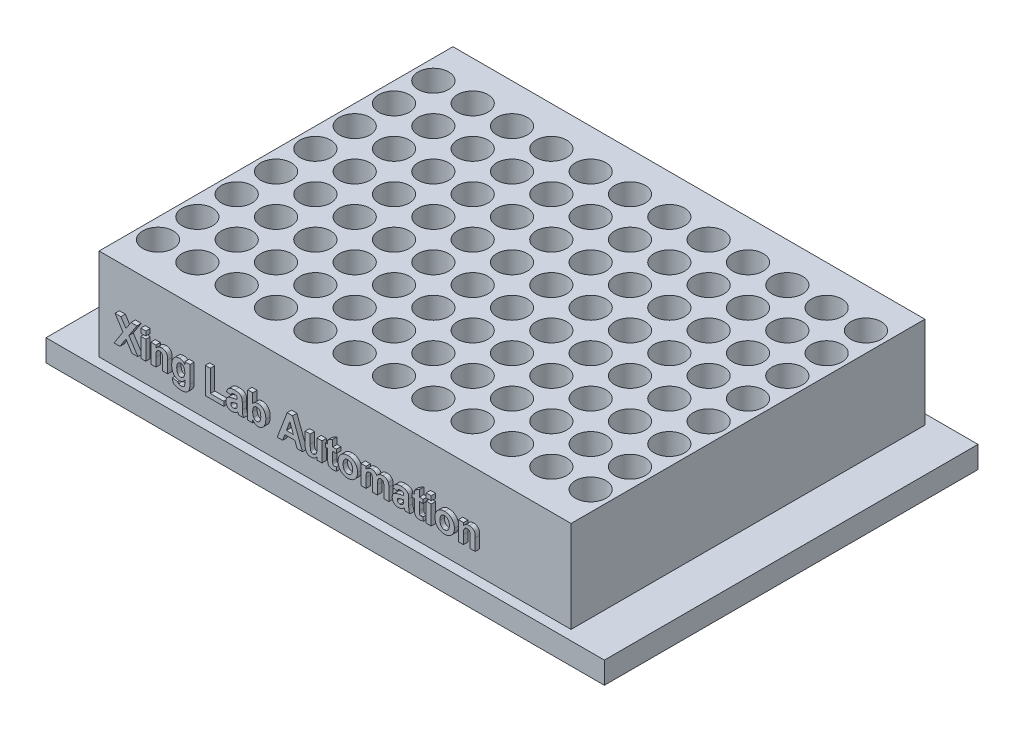
from build123d import *

# Parameters (mm, degrees)
SKETCH_1_W      = 127.77
SKETCH_1_H      = 85.5
EXTRUDE_1_DEPTH = 5
SKETCH_2_W      = 108
SKETCH_2_H      = 80.97
SKETCH_2_R      = 3.5
EXTRUDE_6_DEPTH = 21
SKETCH_4_W      = 1.153846154
SKETCH_4_H      = 1
SKETCH_4_H_2    = 4.384615384
EXTRUDE_8_DEPTH = 1


with BuildPart() as part:
    # 草图1 → 凸台-拉伸1 (new body)
    with BuildSketch(Plane(origin=(0, 0, 0), x_dir=(1, 0, 0), z_dir=(0, 1, 0))):
        Rectangle(SKETCH_1_W, SKETCH_1_H)
    extrude(amount=EXTRUDE_1_DEPTH)

    # 草图2 → 凸台-拉伸6 (add)
    with BuildSketch(Plane(origin=(0, 5, 0), x_dir=(1, 0, 0), z_dir=(0, 1, 0))):
        Rectangle(SKETCH_2_W, SKETCH_2_H)
        with Locations(Location((49.5, 31.5, 0), (0, 0, 90))):
            Circle(SKETCH_2_R, mode=Mode.SUBTRACT)
        with Locations(Location((40.5, 31.5, 0), (0, 0, 90))):
            Circle(SKETCH_2_R, mode=Mode.SUBTRACT)
        with Locations(Location((31.5, 31.5, 0), (0, 0, 90))):
            Circle(SKETCH_2_R, mode=Mode.SUBTRACT)
        with Locations(Location((22.5, 31.5, 0), (0, 0, 90))):
            Circle(SKETCH_2_R, mode=Mode.SUBTRACT)
        with Locations(Location((13.5, 31.5, 0), (0, 0, 90))):
            Circle(SKETCH_2_R, mode=Mode.SUBTRACT)
        with Locations(Location((4.5, 31.5, 0), (0, 0, 90))):
            Circle(SKETCH_2_R, mode=Mode.SUBTRACT)
        with Locations(Location((-4.5, 31.5, 0), (0, 0, 90))):
            Circle(SKETCH_2_R, mode=Mode.SUBTRACT)
        with Locations(Location((-13.5, 31.5, 0), (0, 0, 90))):
            Circle(SKETCH_2_R, mode=Mode.SUBTRACT)
        with Locations(Location((-22.5, 31.5, 0), (0, 0, 90))):
            Circle(SKETCH_2_R, mode=Mode.SUBTRACT)
        with Locations(Location((-31.5, 31.5, 0), (0, 0, 90))):
            Circle(SKETCH_2_R, mode=Mode.SUBTRACT)
        with Locations(Location((-40.5, 31.5, 0), (0, 0, 90))):
            Circle(SKETCH_2_R, mode=Mode.SUBTRACT)
        with Locations(Location((-49.5, 31.5, 0), (0, 0, 90))):
            Circle(SKETCH_2_R, mode=Mode.SUBTRACT)
        with Locations(Location((40.5, 22.5, 0), (0, 0, 90))):
            Circle(SKETCH_2_R, mode=Mode.SUBTRACT)
        with Locations(Location((31.5, 22.5, 0), (0, 0, 90))):
            Circle(SKETCH_2_R, mode=Mode.SUBTRACT)
        with Locations(Location((22.5, 22.5, 0), (0, 0, 90))):
            Circle(SKETCH_2_R, mode=Mode.SUBTRACT)
        with Locations(Location((13.5, 22.5, 0), (0, 0, 90))):
            Circle(SKETCH_2_R, mode=Mode.SUBTRACT)
        with Locations(Location((4.5, 22.5, 0), (0, 0, 90))):
            Circle(SKETCH_2_R, mode=Mode.SUBTRACT)
        with Locations(Location((-4.5, 22.5, 0), (0, 0, 90))):
            Circle(SKETCH_2_R, mode=Mode.SUBTRACT)
        with Locations(Location((-13.5, 22.5, 0), (0, 0, 90))):
            Circle(SKETCH_2_R, mode=Mode.SUBTRACT)
        with Locations(Location((-22.5, 22.5, 0), (0, 0, 90))):
            Circle(SKETCH_2_R, mode=Mode.SUBTRACT)
        with Locations(Location((-31.5, 22.5, 0), (0, 0, 90))):
            Circle(SKETCH_2_R, mode=Mode.SUBTRACT)
        with Locations(Location((-40.5, 22.5, 0), (0, 0, 90))):
            Circle(SKETCH_2_R, mode=Mode.SUBTRACT)
        with Locations(Location((-49.5, 22.5, 0), (0, 0, 90))):
            Circle(SKETCH_2_R, mode=Mode.SUBTRACT)
        with Locations(Location((40.5, 13.5, 0), (0, 0, 90))):
            Circle(SKETCH_2_R, mode=Mode.SUBTRACT)
        with Locations(Location((31.5, 13.5, 0), (0, 0, 90))):
            Circle(SKETCH_2_R, mode=Mode.SUBTRACT)
        with Locations(Location((22.5, 13.5, 0), (0, 0, 90))):
            Circle(SKETCH_2_R, mode=Mode.SUBTRACT)
        with Locations(Location((13.5, 13.5, 0), (0, 0, 90))):
            Circle(SKETCH_2_R, mode=Mode.SUBTRACT)
        with Locations(Location((4.5, 13.5, 0), (0, 0, 90))):
            Circle(SKETCH_2_R, mode=Mode.SUBTRACT)
        with Locations(Location((-4.5, 13.5, 0), (0, 0, 90))):
            Circle(SKETCH_2_R, mode=Mode.SUBTRACT)
        with Locations(Location((-13.5, 13.5, 0), (0, 0, 90))):
            Circle(SKETCH_2_R, mode=Mode.SUBTRACT)
        with Locations(Location((-22.5, 13.5, 0), (0, 0, 90))):
            Circle(SKETCH_2_R, mode=Mode.SUBTRACT)
        with Locations(Location((-31.5, 13.5, 0), (0, 0, 90))):
            Circle(SKETCH_2_R, mode=Mode.SUBTRACT)
        with Locations(Location((-40.5, 13.5, 0), (0, 0, 90))):
            Circle(SKETCH_2_R, mode=Mode.SUBTRACT)
        with Locations(Location((-49.5, 13.5, 0), (0, 0, 90))):
            Circle(SKETCH_2_R, mode=Mode.SUBTRACT)
        with Locations(Location((40.5, 4.5, 0), (0, 0, 90))):
            Circle(SKETCH_2_R, mode=Mode.SUBTRACT)
        with Locations(Location((31.5, 4.5, 0), (0, 0, 90))):
            Circle(SKETCH_2_R, mode=Mode.SUBTRACT)
        with Locations(Location((22.5, 4.5, 0), (0, 0, 90))):
            Circle(SKETCH_2_R, mode=Mode.SUBTRACT)
        with Locations(Location((13.5, 4.5, 0), (0, 0, 90))):
            Circle(SKETCH_2_R, mode=Mode.SUBTRACT)
        with Locations(Location((4.5, 4.5, 0), (0, 0, 90))):
            Circle(SKETCH_2_R, mode=Mode.SUBTRACT)
        with Locations(Location((-4.5, 4.5, 0), (0, 0, 90))):
            Circle(SKETCH_2_R, mode=Mode.SUBTRACT)
        with Locations(Location((-13.5, 4.5, 0), (0, 0, 90))):
            Circle(SKETCH_2_R, mode=Mode.SUBTRACT)
        with Locations(Location((-22.5, 4.5, 0), (0, 0, 90))):
            Circle(SKETCH_2_R, mode=Mode.SUBTRACT)
        with Locations(Location((-31.5, 4.5, 0), (0, 0, 90))):
            Circle(SKETCH_2_R, mode=Mode.SUBTRACT)
        with Locations(Location((-40.5, 4.5, 0), (0, 0, 90))):
            Circle(SKETCH_2_R, mode=Mode.SUBTRACT)
        with Locations(Location((-49.5, 4.5, 0), (0, 0, 90))):
            Circle(SKETCH_2_R, mode=Mode.SUBTRACT)
        with Locations(Location((40.5, -4.5, 0), (0, 0, 90))):
            Circle(SKETCH_2_R, mode=Mode.SUBTRACT)
        with Locations(Location((31.5, -4.5, 0), (0, 0, 90))):
            Circle(SKETCH_2_R, mode=Mode.SUBTRACT)
        with Locations(Location((22.5, -4.5, 0), (0, 0, 90))):
            Circle(SKETCH_2_R, mode=Mode.SUBTRACT)
        with Locations(Location((13.5, -4.5, 0), (0, 0, 90))):
            Circle(SKETCH_2_R, mode=Mode.SUBTRACT)
        with Locations(Location((4.5, -4.5, 0), (0, 0, 90))):
            Circle(SKETCH_2_R, mode=Mode.SUBTRACT)
        with Locations(Location((-4.5, -4.5, 0), (0, 0, 90))):
            Circle(SKETCH_2_R, mode=Mode.SUBTRACT)
        with Locations(Location((-13.5, -4.5, 0), (0, 0, 90))):
            Circle(SKETCH_2_R, mode=Mode.SUBTRACT)
        with Locations(Location((-22.5, -4.5, 0), (0, 0, 90))):
            Circle(SKETCH_2_R, mode=Mode.SUBTRACT)
        with Locations(Location((-31.5, -4.5, 0), (0, 0, 90))):
            Circle(SKETCH_2_R, mode=Mode.SUBTRACT)
        with Locations(Location((-40.5, -4.5, 0), (0, 0, 90))):
            Circle(SKETCH_2_R, mode=Mode.SUBTRACT)
        with Locations(Location((-49.5, -4.5, 0), (0, 0, 90))):
            Circle(SKETCH_2_R, mode=Mode.SUBTRACT)
        with Locations(Location((40.5, -13.5, 0), (0, 0, 90))):
            Circle(SKETCH_2_R, mode=Mode.SUBTRACT)
        with Locations(Location((31.5, -13.5, 0), (0, 0, 90))):
            Circle(SKETCH_2_R, mode=Mode.SUBTRACT)
        with Locations(Location((22.5, -13.5, 0), (0, 0, 90))):
            Circle(SKETCH_2_R, mode=Mode.SUBTRACT)
        with Locations(Location((13.5, -13.5, 0), (0, 0, 90))):
            Circle(SKETCH_2_R, mode=Mode.SUBTRACT)
        with Locations(Location((4.5, -13.5, 0), (0, 0, 90))):
            Circle(SKETCH_2_R, mode=Mode.SUBTRACT)
        with Locations(Location((-4.5, -13.5, 0), (0, 0, 90))):
            Circle(SKETCH_2_R, mode=Mode.SUBTRACT)
        with Locations(Location((-13.5, -13.5, 0), (0, 0, 90))):
            Circle(SKETCH_2_R, mode=Mode.SUBTRACT)
        with Locations(Location((-22.5, -13.5, 0), (0, 0, 90))):
            Circle(SKETCH_2_R, mode=Mode.SUBTRACT)
        with Locations(Location((-31.5, -13.5, 0), (0, 0, 90))):
            Circle(SKETCH_2_R, mode=Mode.SUBTRACT)
        with Locations(Location((-40.5, -13.5, 0), (0, 0, 90))):
            Circle(SKETCH_2_R, mode=Mode.SUBTRACT)
        with Locations(Location((-49.5, -13.5, 0), (0, 0, 90))):
            Circle(SKETCH_2_R, mode=Mode.SUBTRACT)
        with Locations(Location((40.5, -22.5, 0), (0, 0, 90))):
            Circle(SKETCH_2_R, mode=Mode.SUBTRACT)
        with Locations(Location((31.5, -22.5, 0), (0, 0, 90))):
            Circle(SKETCH_2_R, mode=Mode.SUBTRACT)
        with Locations(Location((22.5, -22.5, 0), (0, 0, 90))):
            Circle(SKETCH_2_R, mode=Mode.SUBTRACT)
        with Locations(Location((13.5, -22.5, 0), (0, 0, 90))):
            Circle(SKETCH_2_R, mode=Mode.SUBTRACT)
        with Locations(Location((4.5, -22.5, 0), (0, 0, 90))):
            Circle(SKETCH_2_R, mode=Mode.SUBTRACT)
        with Locations(Location((-4.5, -22.5, 0), (0, 0, 90))):
            Circle(SKETCH_2_R, mode=Mode.SUBTRACT)
        with Locations(Location((-13.5, -22.5, 0), (0, 0, 90))):
            Circle(SKETCH_2_R, mode=Mode.SUBTRACT)
        with Locations(Location((-22.5, -22.5, 0), (0, 0, 90))):
            Circle(SKETCH_2_R, mode=Mode.SUBTRACT)
        with Locations(Location((-31.5, -22.5, 0), (0, 0, 90))):
            Circle(SKETCH_2_R, mode=Mode.SUBTRACT)
        with Locations(Location((-40.5, -22.5, 0), (0, 0, 90))):
            Circle(SKETCH_2_R, mode=Mode.SUBTRACT)
        with Locations(Location((-49.5, -22.5, 0), (0, 0, 90))):
            Circle(SKETCH_2_R, mode=Mode.SUBTRACT)
        with Locations(Location((40.5, -31.5, 0), (0, 0, 90))):
            Circle(SKETCH_2_R, mode=Mode.SUBTRACT)
        with Locations(Location((31.5, -31.5, 0), (0, 0, 90))):
            Circle(SKETCH_2_R, mode=Mode.SUBTRACT)
        with Locations(Location((22.5, -31.5, 0), (0, 0, 90))):
            Circle(SKETCH_2_R, mode=Mode.SUBTRACT)
        with Locations(Location((13.5, -31.5, 0), (0, 0, 90))):
            Circle(SKETCH_2_R, mode=Mode.SUBTRACT)
        with Locations(Location((4.5, -31.5, 0), (0, 0, 90))):
            Circle(SKETCH_2_R, mode=Mode.SUBTRACT)
        with Locations(Location((-4.5, -31.5, 0), (0, 0, 90))):
            Circle(SKETCH_2_R, mode=Mode.SUBTRACT)
        with Locations(Location((-13.5, -31.5, 0), (0, 0, 90))):
            Circle(SKETCH_2_R, mode=Mode.SUBTRACT)
        with Locations(Location((-22.5, -31.5, 0), (0, 0, 90))):
            Circle(SKETCH_2_R, mode=Mode.SUBTRACT)
        with Locations(Location((-31.5, -31.5, 0), (0, 0, 90))):
            Circle(SKETCH_2_R, mode=Mode.SUBTRACT)
        with Locations(Location((-40.5, -31.5, 0), (0, 0, 90))):
            Circle(SKETCH_2_R, mode=Mode.SUBTRACT)
        with Locations(Location((-49.5, -31.5, 0), (0, 0, 90))):
            Circle(SKETCH_2_R, mode=Mode.SUBTRACT)
        with Locations(Location((49.5, 22.5, 0), (0, 0, 90))):
            Circle(SKETCH_2_R, mode=Mode.SUBTRACT)
        with Locations(Location((49.5, 13.5, 0), (0, 0, 90))):
            Circle(SKETCH_2_R, mode=Mode.SUBTRACT)
        with Locations(Location((49.5, 4.5, 0), (0, 0, 90))):
            Circle(SKETCH_2_R, mode=Mode.SUBTRACT)
        with Locations(Location((49.5, -4.5, 0), (0, 0, 90))):
            Circle(SKETCH_2_R, mode=Mode.SUBTRACT)
        with Locations(Location((49.5, -13.5, 0), (0, 0, 90))):
            Circle(SKETCH_2_R, mode=Mode.SUBTRACT)
        with Locations(Location((49.5, -22.5, 0), (0, 0, 90))):
            Circle(SKETCH_2_R, mode=Mode.SUBTRACT)
        with Locations(Location((49.5, -31.5, 0), (0, 0, 90))):
            Circle(SKETCH_2_R, mode=Mode.SUBTRACT)
    extrude(amount=EXTRUDE_6_DEPTH)

    # 草图4 → 凸台-拉伸8 (add)
    # profile 1 of 19: a face of its own
    with BuildSketch(Plane.XY.offset(40.485)):
        Polygon((-49.58051139, 10.482615526), (-47.524021006, 13.660500141), (-49.34974216, 16.482615526), (-48.001184467, 16.482615526), (-46.84974216, 14.702567449), (-45.698299852, 16.482615526), (-44.34974216, 16.482615526), (-46.175463313, 13.660500141), (-44.118972929, 10.482615526), (-45.467530621, 10.482615526), (-46.84974216, 12.618432833), (-48.231953698, 10.482615526), align=None)
    # profile 2 of 19: a face of its own
    with BuildSketch(Plane.XY.offset(40.485)):
        with Locations((-42.888203698, 15.982615526)):
            Rectangle(SKETCH_4_W, SKETCH_4_H)
    # profile 3 of 19: a face of its own
    with BuildSketch(Plane.XY.offset(40.485)):
        with Locations((-42.888203698, 12.674923218)):
            Rectangle(SKETCH_4_W, SKETCH_4_H_2)
    # profile 4 of 19: a face of its own
    with BuildSketch(Plane.XY.offset(40.485)):
        with BuildLine():
            Line((-37.311280621, 10.482615526), (-38.465126775, 10.482615526))
            Line((-38.465126775, 10.482615526), (-38.465126775, 12.732615526))
            add(Edge.make_bspline(
                [(-38.465126775, 12.732615526), (-38.46529931, 12.789509763), (-38.465628623, 12.898102302), (-38.469649145, 13.052747883), (-38.473977646, 13.191817829), (-38.480936067, 13.314880663), (-38.490493518, 13.422717409), (-38.501866536, 13.514657048), (-38.516192263, 13.590886432), (-38.536518142, 13.670394436), (-38.568432451, 13.754763646), (-38.620227159, 13.842147788), (-38.680269925, 13.919739026), (-38.753004902, 13.98321282), (-38.83452116, 14.034396907), (-38.924022967, 14.072130069), (-39.022164347, 14.094164423), (-39.09001388, 14.096695606), (-39.124982544, 14.098000141)],
                knots=[0, 0, 0, 0, 1.585090075, 3.025419896, 4.30986405, 5.461533023, 6.458985685, 7.325703005, 8.041573048, 8.618245387, 9.611190897, 10.541623111, 11.439410311, 12.333024322, 13.215695708, 14.111259627, 15.026570636, 16, 16, 16, 16], degree=3))
            add(Edge.make_bspline(
                [(-39.124982544, 14.098000141), (-39.17000467, 14.095765334), (-39.25866541, 14.091364395), (-39.388849821, 14.060881073), (-39.510439798, 14.006892279), (-39.62394088, 13.934821227), (-39.724023571, 13.845329278), (-39.809118844, 13.740812064), (-39.876235352, 13.622580837), (-39.918050816, 13.512187205), (-39.942863675, 13.412265707), (-39.959749635, 13.322016817), (-39.971847315, 13.216710541), (-39.984625314, 13.097417308), (-39.991833166, 12.963014667), (-39.999875783, 12.814832956), (-40.002836904, 12.651696777), (-40.003330307, 12.538304154), (-40.003588313, 12.479009756)],
                knots=[0, 0, 0, 0, 1.032418065, 2.033110358, 3.045378521, 4.070039643, 5.104744895, 6.110696385, 7.147805894, 8.209255037, 8.806501049, 9.507534436, 10.313289552, 11.236712342, 12.258650821, 13.399345464, 14.640085731, 16, 16, 16, 16], degree=3))
            Line((-40.003588313, 12.479009756), (-40.003588313, 10.482615526))
            Line((-40.003588313, 10.482615526), (-41.157434467, 10.482615526))
            Line((-41.157434467, 10.482615526), (-41.157434467, 14.86723091))
            Line((-41.157434467, 14.86723091), (-40.003588313, 14.86723091))
            Line((-40.003588313, 14.86723091), (-40.003588313, 14.235019372))
            add(Edge.make_bspline(
                [(-40.003588313, 14.235019372), (-39.958979183, 14.291226483), (-39.87207654, 14.400723046), (-39.726585681, 14.546245821), (-39.572497396, 14.669745215), (-39.409116766, 14.770556442), (-39.2365276, 14.84837263), (-39.055520381, 14.903178408), (-38.865945922, 14.938633098), (-38.736521522, 14.942291947), (-38.670655621, 14.944153987)],
                knots=[0, 0, 0, 0, 1.096260936, 2.135615983, 3.138008533, 4.108575778, 5.062498258, 6.023394349, 6.994077526, 8, 8, 8, 8], degree=3))
            add(Edge.make_bspline(
                [(-38.670655621, 14.944153987), (-38.612854081, 14.942700595), (-38.499026069, 14.939838443), (-38.332608575, 14.91236584), (-38.173710012, 14.869229944), (-38.024545781, 14.809062759), (-37.887413975, 14.737313868), (-37.766935105, 14.65342474), (-37.663377064, 14.560911536), (-37.578446419, 14.45704679), (-37.509299902, 14.345282442), (-37.449114419, 14.227998784), (-37.402606595, 14.102431126), (-37.366708778, 13.965989797), (-37.342372456, 13.81133472), (-37.32297207, 13.631692831), (-37.313183653, 13.422625234), (-37.311941428, 13.273488092), (-37.311280621, 13.194153987)],
                knots=[0, 0, 0, 0, 1.087471829, 2.141547729, 3.166311014, 4.181815879, 5.163737, 6.073971965, 6.939083136, 7.769667735, 8.590016746, 9.409741311, 10.247555639, 11.105633939, 12.06171977, 13.192085209, 14.506318385, 16, 16, 16, 16], degree=3))
            Line((-37.311280621, 13.194153987), (-37.311280621, 10.482615526))
        make_face()
    # profile 5 of 19: a face of its own
    with BuildSketch(Plane.XY.offset(40.485)):
        with BuildLine():
            Line((-36.234357544, 10.251846295), (-34.926665236, 10.098000141))
            add(Edge.make_bspline(
                [(-34.926665236, 10.098000141), (-34.921109219, 10.06042382), (-34.910832674, 9.990921739), (-34.878313316, 9.897879791), (-34.839921703, 9.82050891), (-34.80151188, 9.783495149), (-34.78363639, 9.766269372)],
                knots=[0, 0, 0, 0, 1.231279633, 2.277404919, 3.198324109, 4, 4, 4, 4], degree=3))
            add(Edge.make_bspline(
                [(-34.78363639, 9.766269372), (-34.754727241, 9.746068048), (-34.693473558, 9.703264798), (-34.57904441, 9.664152484), (-34.44409869, 9.640658908), (-34.346661381, 9.637925996), (-34.294453698, 9.636461679)],
                knots=[0, 0, 0, 0, 0.817912222, 1.733020108, 2.785334205, 4, 4, 4, 4], degree=3))
            add(Edge.make_bspline(
                [(-34.294453698, 9.636461679), (-34.227827275, 9.63779887), (-34.102844942, 9.640307262), (-33.928749092, 9.665634714), (-33.778831967, 9.704619043), (-33.694461061, 9.749910339), (-33.655030621, 9.771077064)],
                knots=[0, 0, 0, 0, 1.20845169, 2.266895082, 3.190039628, 4, 4, 4, 4], degree=3))
            add(Edge.make_bspline(
                [(-33.655030621, 9.771077064), (-33.631912777, 9.787504305), (-33.584919674, 9.820896996), (-33.525516291, 9.887659427), (-33.475962621, 9.968139403), (-33.451437494, 10.028270518), (-33.438684467, 10.059538603)],
                knots=[0, 0, 0, 0, 0.924769886, 1.87983818, 2.897519225, 4, 4, 4, 4], degree=3))
            add(Edge.make_bspline(
                [(-33.438684467, 10.059538603), (-33.43092291, 10.088264715), (-33.413015398, 10.15454177), (-33.397380107, 10.271403096), (-33.390685959, 10.41762029), (-33.389078715, 10.525075955), (-33.388203698, 10.583577064)],
                knots=[0, 0, 0, 0, 0.675514696, 1.558551481, 2.670824413, 4, 4, 4, 4], degree=3))
            Line((-33.388203698, 10.583577064), (-33.388203698, 11.214586679))
            add(Edge.make_bspline(
                [(-33.388203698, 11.214586679), (-33.433989173, 11.156359392), (-33.522530751, 11.043757395), (-33.669767584, 10.894562593), (-33.822520896, 10.767110266), (-33.982607325, 10.663071352), (-34.149570809, 10.582743463), (-34.3221004, 10.524269775), (-34.50184171, 10.490018079), (-34.623638916, 10.485097619), (-34.685078698, 10.482615526)],
                knots=[0, 0, 0, 0, 1.14820102, 2.220431895, 3.244469247, 4.228720426, 5.173737733, 6.111123218, 7.047168801, 8, 8, 8, 8], degree=3))
            add(Edge.make_bspline(
                [(-34.685078698, 10.482615526), (-34.752947711, 10.484897126), (-34.886004297, 10.489370183), (-35.07984302, 10.525360935), (-35.263321719, 10.582699956), (-35.435204728, 10.665662312), (-35.596337414, 10.770762983), (-35.745331503, 10.900489614), (-35.88456747, 11.05225799), (-35.964827934, 11.167500163), (-36.00599216, 11.22660591)],
                knots=[0, 0, 0, 0, 1.026582672, 2.012606019, 2.973395795, 3.92810037, 4.891813419, 5.87641867, 6.910851312, 8, 8, 8, 8], degree=3))
            add(Edge.make_bspline(
                [(-36.00599216, 11.22660591), (-36.037041199, 11.276532419), (-36.099343663, 11.376714087), (-36.175383533, 11.53856647), (-36.242272284, 11.707593601), (-36.294463361, 11.886920556), (-36.336805289, 12.074300525), (-36.36651791, 12.271110759), (-36.384907908, 12.476653372), (-36.387091752, 12.616790721), (-36.388203698, 12.688144372)],
                knots=[0, 0, 0, 0, 0.920413347, 1.846885479, 2.796895544, 3.766080589, 4.769638637, 5.804757267, 6.882249555, 8, 8, 8, 8], degree=3))
            add(Edge.make_bspline(
                [(-36.388203698, 12.688144372), (-36.38644044, 12.777126853), (-36.383019066, 12.949785826), (-36.36090461, 13.200621096), (-36.3206324, 13.434608761), (-36.267768701, 13.653505695), (-36.196367292, 13.855586645), (-36.111355878, 14.042768905), (-36.008804644, 14.212589519), (-35.891848042, 14.365729287), (-35.763276841, 14.501435657), (-35.625874626, 14.619779416), (-35.480732627, 14.720633932), (-35.32793694, 14.802699724), (-35.167131102, 14.865510358), (-34.999733562, 14.91172475), (-34.82373955, 14.938232717), (-34.703995446, 14.942155942), (-34.64301139, 14.944153987)],
                knots=[0, 0, 0, 0, 1.332435198, 2.585417837, 3.765937015, 4.884806888, 5.952978943, 6.970279126, 7.957945005, 8.91661862, 9.850187725, 10.752032001, 11.627328043, 12.491535037, 13.342629265, 14.207086078, 15.086893139, 16, 16, 16, 16], degree=3))
            add(Edge.make_bspline(
                [(-34.64301139, 14.944153987), (-34.580402319, 14.941985085), (-34.457190734, 14.937716791), (-34.276553865, 14.906664884), (-34.10591138, 14.85066679), (-33.941997713, 14.77876029), (-33.789772271, 14.679782961), (-33.644613975, 14.563163339), (-33.508888647, 14.423631037), (-33.429150891, 14.318072362), (-33.388203698, 14.263865526)],
                knots=[0, 0, 0, 0, 1.010413372, 1.988444031, 2.945493695, 3.903416739, 4.868515011, 5.866269087, 6.904279514, 8, 8, 8, 8], degree=3))
            Line((-33.388203698, 14.263865526), (-33.388203698, 14.86723091))
            Line((-33.388203698, 14.86723091), (-32.234357544, 14.86723091))
            Line((-32.234357544, 14.86723091), (-32.234357544, 10.988625141))
            add(Edge.make_bspline(
                [(-32.234357544, 10.988625141), (-32.23507805, 10.926929456), (-32.236472478, 10.807526912), (-32.239811828, 10.63427527), (-32.252011518, 10.473314603), (-32.263747117, 10.323978027), (-32.282898351, 10.187130652), (-32.301579178, 10.061460836), (-32.328987581, 9.948750797), (-32.365959414, 9.816171777), (-32.423389058, 9.6683436), (-32.503610506, 9.507752254), (-32.597065637, 9.367404981), (-32.705351034, 9.246584869), (-32.829342452, 9.143174829), (-32.970410303, 9.051950336), (-33.131403803, 8.975163505), (-33.310461088, 8.906485432), (-33.512049292, 8.854367408), (-33.736744688, 8.816309228), (-33.986299832, 8.793710495), (-34.160991544, 8.791476572), (-34.25238639, 8.790307833)],
                knots=[0, 0, 0, 0, 1.057414834, 2.046464353, 2.968547764, 3.823244161, 4.612686126, 5.33620079, 5.999021413, 6.598822485, 7.694119615, 8.710459515, 9.670192312, 10.574492796, 11.480823955, 12.429217572, 13.445580662, 14.532019341, 15.711090915, 17.006882078, 18.434066805, 20, 20, 20, 20], degree=3))
            add(Edge.make_bspline(
                [(-34.25238639, 8.790307833), (-34.339348452, 8.791518761), (-34.506634684, 8.793848185), (-34.747947867, 8.809920526), (-34.969112247, 8.839881618), (-35.171068043, 8.88076963), (-35.354517652, 8.930758312), (-35.517577894, 8.996442984), (-35.662267807, 9.071155187), (-35.78624679, 9.160243679), (-35.891694089, 9.25844393), (-35.984549867, 9.361337628), (-36.063377996, 9.471083072), (-36.126884423, 9.587997336), (-36.177025681, 9.710440604), (-36.211514177, 9.839297771), (-36.234070022, 9.974212527), (-36.23665168, 10.06665761), (-36.237963313, 10.113625141)],
                knots=[0, 0, 0, 0, 1.548621642, 2.979035649, 4.303865977, 5.519788843, 6.646809092, 7.684177692, 8.644836651, 9.539739945, 10.393064547, 11.206566714, 12.004431959, 12.793056696, 13.570762087, 14.354823117, 15.164153531, 16, 16, 16, 16], degree=3))
            add(Edge.make_bspline(
                [(-36.237963313, 10.113625141), (-36.237628125, 10.134860788), (-36.236900695, 10.180946635), (-36.235248457, 10.227008842), (-36.234357544, 10.251846295)],
                knots=[0, 0, 0, 0, 0.921569154, 2, 2, 2, 2], degree=3))
        make_face()
        with BuildLine():
            add(Edge.make_bspline(
                [(-35.234357544, 12.730211679), (-35.23379885, 12.671697129), (-35.232718434, 12.558540261), (-35.220686204, 12.394778756), (-35.200419667, 12.243483821), (-35.172997353, 12.104007613), (-35.137764673, 11.976600422), (-35.092462574, 11.861557812), (-35.041953795, 11.757427867), (-34.980783255, 11.666760258), (-34.914660572, 11.587485593), (-34.844882756, 11.518234432), (-34.770768123, 11.460303323), (-34.694116643, 11.41128353), (-34.611994222, 11.375033768), (-34.526812384, 11.349094076), (-34.437859483, 11.330680114), (-34.377081798, 11.329414015), (-34.34613639, 11.328769372)],
                knots=[0, 0, 0, 0, 1.512566013, 2.925037165, 4.241951947, 5.456694731, 6.597752419, 7.653745747, 8.649663045, 9.583307458, 10.473179209, 11.315483628, 12.119469364, 12.901195816, 13.661563954, 14.43146686, 15.201369766, 16, 16, 16, 16], degree=3))
            add(Edge.make_bspline(
                [(-34.34613639, 11.328769372), (-34.313236204, 11.330120442), (-34.24827276, 11.332788213), (-34.152339427, 11.348123482), (-34.061147189, 11.376467201), (-33.972989486, 11.413534194), (-33.890383877, 11.463878399), (-33.809832802, 11.522865221), (-33.734838209, 11.59421623), (-33.663361198, 11.674942063), (-33.598196334, 11.766402219), (-33.54181324, 11.869391848), (-33.493605, 11.98244181), (-33.455842928, 12.106406562), (-33.424055754, 12.239906939), (-33.402971117, 12.384283093), (-33.391381095, 12.538913634), (-33.38928564, 12.645256058), (-33.388203698, 12.700163603)],
                knots=[0, 0, 0, 0, 0.843521127, 1.665584437, 2.480886978, 3.285778206, 4.109890913, 4.953911831, 5.840158033, 6.756811976, 7.714085637, 8.711381888, 9.760304109, 10.857947751, 12.028518885, 13.274436009, 14.592715675, 16, 16, 16, 16], degree=3))
            add(Edge.make_bspline(
                [(-33.388203698, 12.700163603), (-33.388604711, 12.757488766), (-33.389379887, 12.868300615), (-33.403548351, 13.028729449), (-33.42331238, 13.178142961), (-33.451368827, 13.316715645), (-33.490233463, 13.443087093), (-33.535718172, 13.558431415), (-33.589439981, 13.662438621), (-33.652610256, 13.754036511), (-33.721150732, 13.834930407), (-33.794614746, 13.90492753), (-33.872436377, 13.964459299), (-33.954062208, 14.014554757), (-34.041358799, 14.051710837), (-34.132616699, 14.077995344), (-34.228039522, 14.096037029), (-34.29356705, 14.097338161), (-34.326905621, 14.098000141)],
                knots=[0, 0, 0, 0, 1.455437609, 2.81341946, 4.087002319, 5.282413419, 6.399373129, 7.440526251, 8.428193171, 9.365237058, 10.260346975, 11.11685598, 11.937053476, 12.745040807, 13.542710239, 14.338039697, 15.154441134, 16, 16, 16, 16], degree=3))
            add(Edge.make_bspline(
                [(-34.326905621, 14.098000141), (-34.35903977, 14.097309656), (-34.422570883, 14.095944528), (-34.515249302, 14.078077631), (-34.603813252, 14.051443791), (-34.688961913, 14.015842681), (-34.768162461, 13.966826046), (-34.843591781, 13.908506132), (-34.914647827, 13.839682908), (-34.980793451, 13.759988793), (-35.041311408, 13.669818256), (-35.092585861, 13.567731299), (-35.137540392, 13.455341686), (-35.172901232, 13.331598243), (-35.200343703, 13.19692244), (-35.22072292, 13.051246421), (-35.232660874, 12.894275814), (-35.233781419, 12.785921671), (-35.234357544, 12.730211679)],
                knots=[0, 0, 0, 0, 0.836481082, 1.653772601, 2.449976146, 3.245288891, 4.051226255, 4.870050842, 5.726756189, 6.623940248, 7.565256659, 8.550720986, 9.595957226, 10.716278907, 11.900071203, 13.176080532, 14.548089411, 16, 16, 16, 16], degree=3))
        make_face(mode=Mode.SUBTRACT)
    # profile 6 of 19: a face of its own
    with BuildSketch(Plane.XY.offset(40.485)):
        Polygon((-28.695896006, 10.482615526), (-28.695896006, 16.482615526), (-27.542049852, 16.482615526), (-27.542049852, 11.482615526), (-24.465126775, 11.482615526), (-24.465126775, 10.482615526), align=None)
    # profile 7 of 19: a face of its own
    with BuildSketch(Plane.XY.offset(40.485)):
        with BuildLine():
            Line((-22.84974216, 13.559538603), (-23.84974216, 13.713384756))
            add(Edge.make_bspline(
                [(-23.84974216, 13.713384756), (-23.834755718, 13.764069849), (-23.805420065, 13.863284884), (-23.751588667, 14.005460928), (-23.688552647, 14.136902557), (-23.619032856, 14.259180058), (-23.540887155, 14.370956699), (-23.455364549, 14.472523255), (-23.3619817, 14.563532114), (-23.26029231, 14.644687844), (-23.148339983, 14.716781645), (-23.02358338, 14.77790284), (-22.886209476, 14.829367756), (-22.736411152, 14.870727516), (-22.574439728, 14.905305876), (-22.399055449, 14.926474225), (-22.211389515, 14.941754486), (-22.08214886, 14.943338458), (-22.015607544, 14.944153987)],
                knots=[0, 0, 0, 0, 1.047140172, 2.049755565, 3.008539736, 3.933190086, 4.833981818, 5.707167246, 6.560530269, 7.413560864, 8.281243119, 9.193714071, 10.161006392, 11.183910126, 12.270717139, 13.439589873, 14.681737877, 16, 16, 16, 16], degree=3))
            add(Edge.make_bspline(
                [(-22.015607544, 14.944153987), (-21.955099855, 14.943818045), (-21.838026984, 14.943168049), (-21.668422974, 14.934646328), (-21.510764921, 14.920673071), (-21.365259101, 14.900018123), (-21.231425953, 14.875455953), (-21.109692898, 14.844308437), (-20.99969752, 14.807550898), (-20.872605014, 14.750412028), (-20.733001362, 14.670117393), (-20.587294789, 14.561091236), (-20.470394268, 14.43706858), (-20.393028382, 14.321316167), (-20.347339189, 14.216399557), (-20.315099333, 14.123961849), (-20.291934779, 14.015957833), (-20.269135386, 13.893933877), (-20.255144114, 13.757229745), (-20.242517381, 13.60581188), (-20.2356789, 13.439808005), (-20.234808912, 13.323966518), (-20.234357544, 13.263865526)],
                knots=[0, 0, 0, 0, 1.253259065, 2.424859341, 3.516580225, 4.530621704, 5.468151732, 6.333678254, 7.13150538, 7.867126506, 9.216626747, 10.459871386, 11.622324159, 12.731817101, 13.322505456, 13.989117254, 14.756090433, 15.607496751, 16.559714447, 17.600403876, 18.755039204, 20, 20, 20, 20], degree=3))
            Line((-20.234357544, 13.263865526), (-20.234357544, 11.916509756))
            add(Edge.make_bspline(
                [(-20.234357544, 11.916509756), (-20.233983787, 11.870036859), (-20.233262003, 11.780290282), (-20.231782409, 11.650408639), (-20.225082712, 11.530244791), (-20.218043789, 11.419650674), (-20.209934333, 11.318194792), (-20.19941067, 11.226345482), (-20.186241939, 11.143705084), (-20.165114517, 11.045007523), (-20.131129877, 10.925260685), (-20.075564495, 10.781725405), (-20.008909304, 10.632220515), (-19.95465163, 10.533523806), (-19.926665236, 10.482615526)],
                knots=[0, 0, 0, 0, 1.124218554, 2.171045354, 3.141373911, 4.034856482, 4.851737235, 5.603038048, 6.270604849, 6.87504238, 8.043824301, 9.276776929, 10.59534724, 12, 12, 12, 12], degree=3))
            Line((-19.926665236, 10.482615526), (-21.08051139, 10.482615526))
            add(Edge.make_bspline(
                [(-21.08051139, 10.482615526), (-21.088747059, 10.505780693), (-21.106793097, 10.55654032), (-21.131164336, 10.641627008), (-21.160371674, 10.740763314), (-21.17962831, 10.812297476), (-21.18988639, 10.850403987)],
                knots=[0, 0, 0, 0, 0.768508203, 1.683958961, 2.766236402, 4, 4, 4, 4], degree=3))
            add(Edge.make_bspline(
                [(-21.18988639, 10.850403987), (-21.194308871, 10.867226864), (-21.202313925, 10.897677656), (-21.212981424, 10.939093891), (-21.222229541, 10.970757891), (-21.228305792, 10.988638768), (-21.230751775, 10.995836679)],
                knots=[0, 0, 0, 0, 1.381357368, 2.500370598, 3.396327181, 4, 4, 4, 4], degree=3))
            add(Edge.make_bspline(
                [(-21.230751775, 10.995836679), (-21.279564484, 10.948775907), (-21.375082753, 10.856685883), (-21.530865267, 10.737420033), (-21.690020323, 10.634747139), (-21.85513342, 10.550954308), (-22.024962898, 10.485466189), (-22.201190071, 10.439799261), (-22.382872878, 10.411383964), (-22.506289804, 10.407599716), (-22.56849216, 10.405692449)],
                knots=[0, 0, 0, 0, 1.082260538, 2.117802027, 3.127898709, 4.103827344, 5.070056335, 6.029309159, 7.006768236, 8, 8, 8, 8], degree=3))
            add(Edge.make_bspline(
                [(-22.56849216, 10.405692449), (-22.622612394, 10.406945152), (-22.728317278, 10.409391868), (-22.882563496, 10.425554357), (-23.027552875, 10.456208178), (-23.163949495, 10.496976453), (-23.292084115, 10.548230121), (-23.410849633, 10.612625885), (-23.520942788, 10.688719942), (-23.621270824, 10.776233689), (-23.711190984, 10.872284482), (-23.790106052, 10.974482039), (-23.855388599, 11.084196872), (-23.909396551, 11.199313991), (-23.95212773, 11.320841217), (-23.981603365, 11.448225696), (-24.000392091, 11.581817046), (-24.002507107, 11.672855234), (-24.003588313, 11.719394372)],
                knots=[0, 0, 0, 0, 1.186431605, 2.317277787, 3.39378889, 4.430144672, 5.434756152, 6.413230964, 7.385260177, 8.362630794, 9.325691837, 10.265445477, 11.187216893, 12.118354241, 13.048828682, 14.005299944, 14.980300216, 16, 16, 16, 16], degree=3))
            add(Edge.make_bspline(
                [(-24.003588313, 11.719394372), (-24.001624575, 11.780449538), (-23.997771342, 11.900251518), (-23.964106908, 12.074300212), (-23.911390047, 12.238705608), (-23.836463108, 12.391405403), (-23.743231486, 12.53103254), (-23.631072878, 12.654277932), (-23.501603732, 12.759216993), (-23.351996805, 12.848334178), (-23.176532332, 12.923404657), (-22.971613367, 12.995723697), (-22.73225064, 13.060538571), (-22.560665697, 13.09762188), (-22.469934467, 13.11723091)],
                knots=[0, 0, 0, 0, 0.9565892, 1.877012003, 2.769038917, 3.656897043, 4.535078379, 5.39337207, 6.259743944, 7.138913465, 8.11486349, 9.247429708, 10.544487161, 12, 12, 12, 12], degree=3))
            add(Edge.make_bspline(
                [(-22.469934467, 13.11723091), (-22.407414228, 13.12995285), (-22.287064965, 13.154442136), (-22.114189003, 13.191262707), (-21.956253239, 13.228375003), (-21.813927906, 13.26607656), (-21.685707916, 13.300330895), (-21.572931482, 13.334848389), (-21.475153586, 13.369588504), (-21.415759798, 13.394250411), (-21.388203698, 13.405692449)],
                knots=[0, 0, 0, 0, 1.365613701, 2.628758346, 3.783158308, 4.837685682, 5.780080249, 6.623655076, 7.36143661, 8, 8, 8, 8], degree=3))
            Line((-21.388203698, 13.405692449), (-21.388203698, 13.515067449))
            add(Edge.make_bspline(
                [(-21.388203698, 13.515067449), (-21.389741236, 13.564101778), (-21.39259653, 13.655161314), (-21.420982898, 13.781428411), (-21.470258583, 13.885429392), (-21.529737345, 13.954745399), (-21.588585714, 13.996560042), (-21.640548316, 14.024389114), (-21.701438941, 14.046598724), (-21.770402279, 14.066283588), (-21.84862357, 14.079735025), (-21.935199847, 14.090904535), (-22.030363197, 14.096385175), (-22.096532474, 14.097447107), (-22.13099216, 14.098000141)],
                knots=[0, 0, 0, 0, 1.600506204, 2.972230995, 4.195852174, 5.327580964, 5.908906329, 6.547275261, 7.247479517, 8.022494018, 8.887774365, 9.837646189, 10.873887764, 12, 12, 12, 12], degree=3))
            add(Edge.make_bspline(
                [(-22.13099216, 14.098000141), (-22.176782392, 14.096905984), (-22.263795699, 14.094826803), (-22.386418148, 14.071563439), (-22.494315529, 14.035097056), (-22.587839798, 13.98065356), (-22.668464794, 13.906692676), (-22.738669633, 13.811317962), (-22.800863388, 13.694114141), (-22.832836299, 13.606084685), (-22.84974216, 13.559538603)],
                knots=[0, 0, 0, 0, 1.120680009, 2.129582446, 3.045508635, 3.899130849, 4.760899303, 5.707254252, 6.787697471, 8, 8, 8, 8], degree=3))
        make_face()
        with BuildLine():
            add(Edge.make_bspline(
                [(-21.388203698, 12.559538603), (-21.427805045, 12.547309341), (-21.516997828, 12.519765787), (-21.666815799, 12.479298293), (-21.84739969, 12.436654744), (-22.013928226, 12.399755901), (-22.152943873, 12.369786818), (-22.251009894, 12.345283432), (-22.339379355, 12.321918743), (-22.418184401, 12.297382178), (-22.487530502, 12.274285203), (-22.546408087, 12.249536244), (-22.596866493, 12.22786493), (-22.625167945, 12.209722155), (-22.638203698, 12.201365526)],
                knots=[0, 0, 0, 0, 1.144223484, 2.577096135, 4.283377528, 6.266557578, 7.286341447, 8.209198618, 9.057088726, 9.80932547, 10.487940513, 11.073343897, 11.57317876, 12, 12, 12, 12], degree=3))
            add(Edge.make_bspline(
                [(-22.638203698, 12.201365526), (-22.670475225, 12.175948313), (-22.73240827, 12.127169546), (-22.799922465, 12.032905623), (-22.842764466, 11.92840009), (-22.847387781, 11.854422518), (-22.84974216, 11.816750141)],
                knots=[0, 0, 0, 0, 1.075028234, 2.063111864, 3.013658082, 4, 4, 4, 4], degree=3))
            add(Edge.make_bspline(
                [(-22.84974216, 11.816750141), (-22.847665589, 11.779266931), (-22.843592238, 11.705740778), (-22.811147872, 11.599792489), (-22.756589423, 11.50272755), (-22.682281538, 11.416437625), (-22.592866667, 11.341733015), (-22.487467092, 11.290529945), (-22.371348891, 11.257467497), (-22.289886658, 11.253767772), (-22.247578698, 11.251846295)],
                knots=[0, 0, 0, 0, 0.976809721, 1.916086158, 2.861451878, 3.862738809, 4.873423621, 5.878632484, 6.898253484, 8, 8, 8, 8], degree=3))
            add(Edge.make_bspline(
                [(-22.247578698, 11.251846295), (-22.199234568, 11.254033787), (-22.101908702, 11.258437623), (-21.9591675, 11.298675428), (-21.818237576, 11.358065851), (-21.732665833, 11.416516113), (-21.688684467, 11.446557833)],
                knots=[0, 0, 0, 0, 0.962503947, 1.937702252, 2.940039444, 4, 4, 4, 4], degree=3))
            add(Edge.make_bspline(
                [(-21.688684467, 11.446557833), (-21.657623203, 11.471564128), (-21.597229567, 11.520184848), (-21.525248838, 11.609034552), (-21.46584878, 11.703549449), (-21.442175416, 11.773274614), (-21.430271006, 11.808336679)],
                knots=[0, 0, 0, 0, 1.055399509, 2.052054707, 3.020454315, 4, 4, 4, 4], degree=3))
            add(Edge.make_bspline(
                [(-21.430271006, 11.808336679), (-21.423710039, 11.837089943), (-21.408351675, 11.904397564), (-21.397515979, 12.022889613), (-21.38875058, 12.17197545), (-21.388397085, 12.281870111), (-21.388203698, 12.341990526)],
                knots=[0, 0, 0, 0, 0.659054705, 1.542760655, 2.655710416, 4, 4, 4, 4], degree=3))
            Line((-21.388203698, 12.341990526), (-21.388203698, 12.559538603))
        make_face(mode=Mode.SUBTRACT)
    # profile 8 of 19: a face of its own
    with BuildSketch(Plane.XY.offset(40.485)):
        with BuildLine():
            Line((-19.003588313, 10.482615526), (-19.003588313, 16.482615526))
            Line((-19.003588313, 16.482615526), (-17.84974216, 16.482615526))
            Line((-17.84974216, 16.482615526), (-17.84974216, 14.344394372))
            add(Edge.make_bspline(
                [(-17.84974216, 14.344394372), (-17.806549889, 14.392135676), (-17.722393397, 14.485155575), (-17.583807295, 14.60754388), (-17.439601754, 14.711737258), (-17.288393268, 14.795914481), (-17.132122556, 14.863519167), (-16.969290739, 14.909951543), (-16.800272145, 14.938592292), (-16.685593557, 14.942281476), (-16.62738639, 14.944153987)],
                knots=[0, 0, 0, 0, 1.09742733, 2.138244462, 3.14714167, 4.12618092, 5.084514129, 6.044794579, 7.007600552, 8, 8, 8, 8], degree=3))
            add(Edge.make_bspline(
                [(-16.62738639, 14.944153987), (-16.564365515, 14.942855849), (-16.440886713, 14.940312367), (-16.260224261, 14.910878166), (-16.087555629, 14.867119516), (-15.922631738, 14.80444405), (-15.76729226, 14.721675932), (-15.619429114, 14.622717274), (-15.480774711, 14.505048844), (-15.350902664, 14.37066077), (-15.233120204, 14.218865308), (-15.12904982, 14.05131908), (-15.042705368, 13.867065003), (-14.971787991, 13.66776969), (-14.916703201, 13.45251002), (-14.877377898, 13.221810183), (-14.854881492, 12.975449702), (-14.851488052, 12.80637944), (-14.84974216, 12.719394372)],
                knots=[0, 0, 0, 0, 0.942730505, 1.847121823, 2.733183872, 3.606606819, 4.481367714, 5.363155244, 6.265634696, 7.198966623, 8.156505419, 9.137011998, 10.145934455, 11.197093156, 12.299939524, 13.468576766, 14.697606431, 16, 16, 16, 16], degree=3))
            add(Edge.make_bspline(
                [(-14.84974216, 12.719394372), (-14.851500976, 12.629209578), (-14.854915044, 12.454150363), (-14.877147393, 12.199341881), (-14.917331514, 11.960945253), (-14.97008466, 11.737658764), (-15.041442437, 11.530920987), (-15.128266145, 11.340331018), (-15.229059657, 11.164155897), (-15.346932275, 11.006325407), (-15.475709529, 10.866208746), (-15.610311834, 10.742245375), (-15.752910188, 10.63792813), (-15.902928136, 10.553661237), (-16.058969267, 10.486375549), (-16.222147552, 10.43972375), (-16.392015272, 10.411282865), (-16.507483835, 10.407574552), (-16.566088313, 10.405692449)],
                knots=[0, 0, 0, 0, 1.342990017, 2.606900428, 3.804454117, 4.940338677, 6.01953414, 7.05541413, 8.055152764, 9.03596787, 9.981868581, 10.885627531, 11.756739119, 12.606254667, 13.442893865, 14.281233033, 15.127663507, 16, 16, 16, 16], degree=3))
            add(Edge.make_bspline(
                [(-16.566088313, 10.405692449), (-16.624719315, 10.407817046), (-16.742468413, 10.41208389), (-16.91829093, 10.445690792), (-17.091874703, 10.502215082), (-17.263780249, 10.577017146), (-17.429293578, 10.675373214), (-17.582323084, 10.800095245), (-17.726218474, 10.945834428), (-17.807892342, 11.05836708), (-17.84974216, 11.116028987)],
                knots=[0, 0, 0, 0, 0.921157575, 1.849967926, 2.801929881, 3.785969375, 4.79143669, 5.817208272, 6.881534093, 8, 8, 8, 8], degree=3))
            Line((-17.84974216, 11.116028987), (-17.84974216, 10.482615526))
            Line((-17.84974216, 10.482615526), (-19.003588313, 10.482615526))
        make_face()
        with BuildLine():
            add(Edge.make_bspline(
                [(-17.84974216, 12.75785591), (-17.84902591, 12.70134804), (-17.84764312, 12.592254047), (-17.83778439, 12.434682349), (-17.823097973, 12.288454337), (-17.799274437, 12.153974936), (-17.773622299, 12.029447519), (-17.736025688, 11.917767774), (-17.697085275, 11.81550522), (-17.662206025, 11.754683445), (-17.645415236, 11.725403987)],
                knots=[0, 0, 0, 0, 1.27404814, 2.459675089, 3.559050391, 4.585286877, 5.538680085, 6.421449734, 7.240089651, 8, 8, 8, 8], degree=3))
            add(Edge.make_bspline(
                [(-17.645415236, 11.725403987), (-17.62137697, 11.687968309), (-17.574728557, 11.615321016), (-17.493401539, 11.518768112), (-17.407060387, 11.435786494), (-17.312927917, 11.369444797), (-17.214785994, 11.31519424), (-17.108801012, 11.279658522), (-16.998280015, 11.25545439), (-16.921991057, 11.253058427), (-16.883396006, 11.251846295)],
                knots=[0, 0, 0, 0, 1.13317841, 2.199034441, 3.210601728, 4.17712673, 5.127651621, 6.057985678, 7.017523073, 8, 8, 8, 8], degree=3))
            add(Edge.make_bspline(
                [(-16.883396006, 11.251846295), (-16.853273494, 11.252624439), (-16.794202086, 11.25415041), (-16.707365727, 11.270614881), (-16.623787641, 11.297181686), (-16.543523062, 11.334487781), (-16.466726254, 11.381928953), (-16.394194079, 11.440568004), (-16.324878436, 11.50924556), (-16.257826036, 11.587442105), (-16.197950839, 11.678292708), (-16.144444416, 11.780594521), (-16.102272881, 11.896672932), (-16.064348172, 12.023168802), (-16.037830272, 12.162630619), (-16.017104992, 12.313416966), (-16.005291237, 12.476417188), (-16.004167487, 12.589167905), (-16.003588313, 12.647278987)],
                knots=[0, 0, 0, 0, 0.78356255, 1.536596371, 2.292155343, 3.062338243, 3.835342336, 4.636962799, 5.485351512, 6.373661662, 7.314050153, 8.312593822, 9.372473365, 10.524658142, 11.748175488, 13.064264604, 14.486938588, 16, 16, 16, 16], degree=3))
            add(Edge.make_bspline(
                [(-16.003588313, 12.647278987), (-16.004130545, 12.709399365), (-16.005174158, 12.828960003), (-16.017284396, 13.001512328), (-16.037380588, 13.160911786), (-16.065792474, 13.30671776), (-16.101765785, 13.439534255), (-16.145937235, 13.558856263), (-16.198272326, 13.665418425), (-16.260338726, 13.757587461), (-16.328590376, 13.836840681), (-16.398787988, 13.907749525), (-16.475882485, 13.965648917), (-16.556508006, 14.014368517), (-16.642591776, 14.052004737), (-16.733601069, 14.077941879), (-16.828599651, 14.095978536), (-16.893727078, 14.097321127), (-16.926665236, 14.098000141)],
                knots=[0, 0, 0, 0, 1.541669275, 2.967189997, 4.290690924, 5.527159073, 6.651403144, 7.702408128, 8.680806828, 9.590976681, 10.451726763, 11.274471125, 12.062089487, 12.838070645, 13.608488225, 14.385742736, 15.183590336, 16, 16, 16, 16], degree=3))
            add(Edge.make_bspline(
                [(-16.926665236, 14.098000141), (-16.959182247, 14.097207413), (-17.023009788, 14.09565137), (-17.116674339, 14.07944021), (-17.205685385, 14.052888979), (-17.291061537, 14.016634833), (-17.371630621, 13.969029343), (-17.449214643, 13.912596948), (-17.521566044, 13.844553001), (-17.588651028, 13.766279134), (-17.650769893, 13.677841898), (-17.704591229, 13.578316633), (-17.748976265, 13.467143596), (-17.78594782, 13.346141361), (-17.814814671, 13.214292768), (-17.834457583, 13.071616397), (-17.848504694, 12.918390813), (-17.849321884, 12.812377729), (-17.84974216, 12.75785591)],
                knots=[0, 0, 0, 0, 0.853654749, 1.675636261, 2.488263676, 3.289909134, 4.105938102, 4.941754496, 5.805666242, 6.708768126, 7.646124924, 8.639937881, 9.673965161, 10.786053658, 11.960883777, 13.21578984, 14.568099356, 16, 16, 16, 16], degree=3))
        make_face(mode=Mode.SUBTRACT)
    # profile 9 of 19: a face of its own
    with BuildSketch(Plane.XY.offset(40.485)):
        Polygon((-6.465126775, 10.482615526), (-7.688684467, 10.482615526), (-8.194694083, 11.86723091), (-10.497578698, 11.86723091), (-11.003588313, 10.482615526), (-12.234357544, 10.482615526), (-9.966328698, 16.482615526), (-8.743972929, 16.482615526), align=None)
        Polygon((-8.561280621, 12.86723091), (-9.34974216, 15.021077064), (-10.135799852, 12.86723091), align=None, mode=Mode.SUBTRACT)
    # profile 10 of 19: a face of its own
    with BuildSketch(Plane.XY.offset(40.485)):
        with BuildLine():
            Line((-3.157434467, 10.482615526), (-3.157434467, 11.128048218))
            add(Edge.make_bspline(
                [(-3.157434467, 11.128048218), (-3.195636937, 11.072805542), (-3.271444944, 10.963183386), (-3.410758049, 10.819533111), (-3.566765274, 10.694886898), (-3.73837932, 10.591004322), (-3.920330696, 10.508149402), (-4.10957246, 10.448659835), (-4.303919166, 10.412923441), (-4.435334028, 10.408106274), (-4.501184467, 10.405692449)],
                knots=[0, 0, 0, 0, 1.012300957, 2.008784164, 3.006972158, 4.019128624, 5.028517728, 6.017265291, 7.006475003, 8, 8, 8, 8], degree=3))
            add(Edge.make_bspline(
                [(-4.501184467, 10.405692449), (-4.567858923, 10.407899554), (-4.698617693, 10.412228025), (-4.889140617, 10.449335075), (-5.068985999, 10.509984441), (-5.237259074, 10.593381161), (-5.388335151, 10.700122951), (-5.51985789, 10.82650769), (-5.62614467, 10.974500711), (-5.696741451, 11.112107813), (-5.741043099, 11.233091653), (-5.76936643, 11.333314134), (-5.795043278, 11.441862943), (-5.814744914, 11.558745334), (-5.830728194, 11.683829972), (-5.84077061, 11.817030751), (-5.848569211, 11.958887066), (-5.849343888, 12.056321379), (-5.84974216, 12.106413603)],
                knots=[0, 0, 0, 0, 1.289498181, 2.528902495, 3.740215999, 4.953909685, 6.150063847, 7.307074614, 8.467199117, 9.660131987, 10.288158488, 10.958106275, 11.674712228, 12.445953132, 13.25095176, 14.114470792, 15.030625377, 16, 16, 16, 16], degree=3))
            Line((-5.84974216, 12.106413603), (-5.84974216, 14.86723091))
            Line((-5.84974216, 14.86723091), (-4.695896006, 14.86723091))
            Line((-4.695896006, 14.86723091), (-4.695896006, 12.844394372))
            add(Edge.make_bspline(
                [(-4.695896006, 12.844394372), (-4.695557687, 12.770676645), (-4.694915966, 12.630849467), (-4.693047768, 12.432103907), (-4.687921462, 12.256226507), (-4.682445261, 12.102720337), (-4.674325276, 11.971637824), (-4.663796587, 11.862984079), (-4.652043542, 11.776747954), (-4.635974436, 11.692678533), (-4.602981544, 11.608301725), (-4.557536562, 11.517665294), (-4.495411626, 11.439863909), (-4.423544961, 11.372291503), (-4.33979872, 11.316298561), (-4.243197158, 11.280942205), (-4.138000764, 11.254551216), (-4.063872635, 11.252773289), (-4.025222929, 11.251846295)],
                knots=[0, 0, 0, 0, 1.799930418, 3.414093185, 4.852592097, 6.095879458, 7.164323302, 8.058836106, 8.760219181, 9.289718358, 10.143846288, 10.96209893, 11.756558504, 12.559405005, 13.365225682, 14.195378484, 15.059087384, 16, 16, 16, 16], degree=3))
            add(Edge.make_bspline(
                [(-4.025222929, 11.251846295), (-3.980596499, 11.254070331), (-3.892717765, 11.25844992), (-3.764282175, 11.288970659), (-3.644334827, 11.341975567), (-3.532488188, 11.412482678), (-3.434566403, 11.499777801), (-3.349535148, 11.596737094), (-3.283298787, 11.704485855), (-3.241063739, 11.804907617), (-3.215754344, 11.900018636), (-3.201867714, 11.994418826), (-3.18663149, 12.10968288), (-3.177315098, 12.247386493), (-3.166838845, 12.406766403), (-3.16178054, 12.588360493), (-3.157973941, 12.791892563), (-3.157620553, 12.934936441), (-3.157434467, 13.010259756)],
                knots=[0, 0, 0, 0, 0.960139447, 1.890714513, 2.821289579, 3.770841791, 4.723832156, 5.63466777, 6.536687779, 7.433335375, 7.968708987, 8.650470788, 9.484586637, 10.470508532, 11.619255361, 12.921832212, 14.379114108, 16, 16, 16, 16], degree=3))
            Line((-3.157434467, 13.010259756), (-3.157434467, 14.86723091))
            Line((-3.157434467, 14.86723091), (-2.003588313, 14.86723091))
            Line((-2.003588313, 14.86723091), (-2.003588313, 10.482615526))
            Line((-2.003588313, 10.482615526), (-3.157434467, 10.482615526))
        make_face()
    # profile 11 of 19: a face of its own
    with BuildSketch(Plane.XY.offset(40.485)):
        with BuildLine():
            Line((1.304103994, 14.86723091), (1.304103994, 14.021077064))
            Line((1.304103994, 14.021077064), (0.457950148, 14.021077064))
            Line((0.457950148, 14.021077064), (0.457950148, 12.136461679))
            add(Edge.make_bspline(
                [(0.457950148, 12.136461679), (0.457862347, 12.091189152), (0.457696843, 12.005850439), (0.458785639, 11.885247515), (0.461344684, 11.779482925), (0.464002031, 11.688551552), (0.465338642, 11.612330651), (0.470533481, 11.551453023), (0.475252638, 11.505388862), (0.482576509, 11.448658581), (0.516217182, 11.380028691), (0.572089027, 11.320046661), (0.629523129, 11.285228488), (0.678276576, 11.266021206), (0.731362317, 11.253482338), (0.76837478, 11.252399368), (0.787277071, 11.251846295)],
                knots=[0, 0, 0, 0, 1.772607892, 3.341365874, 4.72216035, 5.914769548, 6.903535532, 7.706019004, 8.305410619, 8.718065781, 9.939723765, 11.215765275, 11.877591902, 12.553399735, 13.261220211, 14, 14, 14, 14], degree=3))
            add(Edge.make_bspline(
                [(0.787277071, 11.251846295), (0.818201656, 11.253595282), (0.886587047, 11.257462922), (0.997541433, 11.279683951), (1.126137714, 11.315047845), (1.216923595, 11.345878446), (1.265642456, 11.362423218)],
                knots=[0, 0, 0, 0, 0.753421026, 1.666085143, 2.747540144, 4, 4, 4, 4], degree=3))
            Line((1.265642456, 11.362423218), (1.381027071, 10.558336679))
            add(Edge.make_bspline(
                [(1.381027071, 10.558336679), (1.310958547, 10.534298774), (1.168420349, 10.485399217), (0.941380874, 10.440911069), (0.701964841, 10.410693766), (0.53738069, 10.407385633), (0.453142456, 10.405692449)],
                knots=[0, 0, 0, 0, 0.939547081, 1.911291127, 2.930947196, 4, 4, 4, 4], degree=3))
            add(Edge.make_bspline(
                [(0.453142456, 10.405692449), (0.401406631, 10.407229708), (0.300376659, 10.410231676), (0.152435626, 10.429259444), (0.012702344, 10.462997564), (-0.117819017, 10.509498668), (-0.235692674, 10.566641364), (-0.339509696, 10.630782678), (-0.424669111, 10.705403921), (-0.495803855, 10.787766157), (-0.55191168, 10.883399298), (-0.59645537, 10.992225189), (-0.634736881, 11.114723124), (-0.650419131, 11.20233385), (-0.65863639, 11.248240526)],
                knots=[0, 0, 0, 0, 1.203015215, 2.349253984, 3.460901624, 4.539344044, 5.564274864, 6.502382232, 7.367332183, 8.186789841, 9.022345106, 9.932420497, 10.916620053, 12, 12, 12, 12], degree=3))
            add(Edge.make_bspline(
                [(-0.65863639, 11.248240526), (-0.661517648, 11.267459608), (-0.667927963, 11.310218831), (-0.676625381, 11.381069565), (-0.681992033, 11.465341983), (-0.686389816, 11.562734377), (-0.692031062, 11.673267334), (-0.69322377, 11.796724672), (-0.696675745, 11.933321261), (-0.696164498, 12.028686376), (-0.695896006, 12.078769372)],
                knots=[0, 0, 0, 0, 0.560521704, 1.24706641, 2.057998689, 2.995119087, 4.059211621, 5.249632546, 6.555586685, 8, 8, 8, 8], degree=3))
            Line((-0.695896006, 12.078769372), (-0.695896006, 14.021077064))
            Line((-0.695896006, 14.021077064), (-1.234357544, 14.021077064))
            Line((-1.234357544, 14.021077064), (-1.234357544, 14.86723091))
            Line((-1.234357544, 14.86723091), (-0.695896006, 14.86723091))
            Line((-0.695896006, 14.86723091), (-0.695896006, 15.713384756))
            Line((-0.695896006, 15.713384756), (0.457950148, 16.405692449))
            Line((0.457950148, 16.405692449), (0.457950148, 14.86723091))
            Line((0.457950148, 14.86723091), (1.304103994, 14.86723091))
        make_face()
    # profile 12 of 19: a face of its own
    with BuildSketch(Plane.XY.offset(40.485)):
        with BuildLine():
            add(Edge.make_bspline(
                [(1.688719379, 12.736221295), (1.692421295, 12.830984752), (1.699832302, 13.02069535), (1.752768171, 13.302500518), (1.842370424, 13.578648709), (1.942666303, 13.802704352), (2.041698614, 13.973993364), (2.12167352, 14.09751077), (2.210956779, 14.211748857), (2.307721005, 14.317431572), (2.409789517, 14.417092468), (2.520756288, 14.507065274), (2.639186128, 14.588900364), (2.763922664, 14.663500522), (2.894787574, 14.729001492), (3.029351329, 14.787225203), (3.168157713, 14.835065459), (3.310239612, 14.87473844), (3.456213127, 14.90655758), (3.606118516, 14.927390052), (3.759774241, 14.941281057), (3.863367738, 14.94318753), (3.91588284, 14.944153987)],
                knots=[0, 0, 0, 0, 1.619840069, 3.242819969, 4.882696853, 6.574901176, 7.427927767, 8.263869039, 9.088735507, 9.903385011, 10.712399333, 11.525463381, 12.34252837, 13.171904741, 14.008210778, 14.842888174, 15.67691885, 16.516221154, 17.363978437, 18.229048737, 19.10224397, 20, 20, 20, 20], degree=3))
            add(Edge.make_bspline(
                [(3.91588284, 14.944153987), (3.995705023, 14.942446849), (4.152731585, 14.93908856), (4.382609613, 14.908498497), (4.601147973, 14.858102036), (4.808641583, 14.787929573), (5.005246838, 14.697973952), (5.189974793, 14.586160515), (5.364351646, 14.455769806), (5.525076982, 14.306006509), (5.671987354, 14.142024699), (5.799401471, 13.964744903), (5.908151085, 13.777596449), (5.998219794, 13.580281819), (6.066587509, 13.371759716), (6.113819743, 13.15254058), (6.145447899, 12.923437517), (6.148634082, 12.766779387), (6.15025784, 12.686942449)],
                knots=[0, 0, 0, 0, 1.076054793, 2.116819909, 3.120736197, 4.09633837, 5.065772102, 6.030360709, 7.002891056, 7.996945094, 8.988102315, 9.967288529, 10.93568283, 11.902870597, 12.887008047, 13.888537105, 14.923945207, 16, 16, 16, 16], degree=3))
            add(Edge.make_bspline(
                [(6.15025784, 12.686942449), (6.148627616, 12.606307933), (6.145436294, 12.448458131), (6.113996471, 12.217227766), (6.065381071, 11.996071035), (5.995617765, 11.785436539), (5.90574211, 11.585565932), (5.797465153, 11.395776516), (5.6679185, 11.217066386), (5.519585696, 11.051298161), (5.356784088, 10.90071526), (5.183659527, 10.766849547), (4.99812306, 10.656489873), (4.80342931, 10.563689329), (4.597575175, 10.493264634), (4.381733474, 10.443031708), (4.156068798, 10.410270294), (4.001736649, 10.407237735), (3.923094379, 10.405692449)],
                knots=[0, 0, 0, 0, 1.084306555, 2.122634113, 3.133511532, 4.127271514, 5.10202058, 6.077484774, 7.061903265, 8.065960046, 9.065303363, 10.042062392, 11.004391854, 11.964060687, 12.939122686, 13.924942149, 14.942623041, 16, 16, 16, 16], degree=3))
            add(Edge.make_bspline(
                [(3.923094379, 10.405692449), (3.825122579, 10.408901828), (3.629876078, 10.415297749), (3.340952305, 10.467760048), (3.059165093, 10.5524055), (2.832143432, 10.649835474), (2.6587238, 10.744842561), (2.535739071, 10.824816416), (2.419753457, 10.910643168), (2.313480818, 11.006736854), (2.215087018, 11.110338178), (2.123268607, 11.220444046), (2.041294929, 11.339595938), (1.96687634, 11.46562908), (1.900099646, 11.599444294), (1.844431668, 11.741409196), (1.796066359, 11.88985631), (1.756176249, 12.045122724), (1.726598072, 12.207874216), (1.705091844, 12.377589297), (1.691614939, 12.554515092), (1.689696572, 12.674899145), (1.688719379, 12.736221295)],
                knots=[0, 0, 0, 0, 1.610846835, 3.210231987, 4.81374032, 6.443368681, 7.263437361, 8.06418174, 8.855100662, 9.634539345, 10.417731031, 11.204243685, 11.990424874, 12.794120493, 13.610605693, 14.447765341, 15.300248309, 16.177865431, 17.082777535, 18.019649293, 18.991233806, 20, 20, 20, 20], degree=3))
        make_face()
        with BuildLine():
            add(Edge.make_bspline(
                [(2.842565533, 12.674923218), (2.843420685, 12.619197725), (2.845084811, 12.510755902), (2.859916659, 12.352979885), (2.882905261, 12.204819147), (2.918406058, 12.06765099), (2.961216536, 11.939621834), (3.015559772, 11.822434481), (3.077656606, 11.71386953), (3.15155878, 11.617988068), (3.232104979, 11.533113788), (3.316525217, 11.457698205), (3.405647504, 11.393482352), (3.50001923, 11.341273228), (3.599523748, 11.301638285), (3.702986757, 11.272554386), (3.811152366, 11.255468454), (3.884573056, 11.253066962), (3.921892456, 11.251846295)],
                knots=[0, 0, 0, 0, 1.334287467, 2.596523749, 3.792235791, 4.920928783, 5.98599801, 7.020725633, 8.009778093, 8.975087571, 9.91178927, 10.809031968, 11.682407688, 12.537028737, 13.385161363, 14.241880569, 15.106355953, 16, 16, 16, 16], degree=3))
            add(Edge.make_bspline(
                [(3.921892456, 11.251846295), (3.959213474, 11.253062956), (4.032637346, 11.255456566), (4.140779752, 11.272599964), (4.243970827, 11.301369678), (4.342830904, 11.341597087), (4.436958456, 11.393434959), (4.526025248, 11.457741185), (4.610384598, 11.532802728), (4.690275807, 11.618134921), (4.762039847, 11.715321947), (4.824745189, 11.823547979), (4.879086749, 11.941183914), (4.922095031, 12.06989216), (4.955650189, 12.208638921), (4.979182143, 12.35776197), (4.993894267, 12.517175533), (4.99555532, 12.626812605), (4.996411687, 12.683336679)],
                knots=[0, 0, 0, 0, 0.891374549, 1.753654511, 2.608197993, 3.445305504, 4.297756158, 5.168913853, 6.063877914, 6.991658187, 7.956416983, 8.942957645, 9.975057474, 11.046479855, 12.179282068, 13.381405243, 14.649967197, 16, 16, 16, 16], degree=3))
            add(Edge.make_bspline(
                [(4.996411687, 12.683336679), (4.995551071, 12.738658276), (4.993882832, 12.845895001), (4.979253654, 13.001731164), (4.955328617, 13.147967623), (4.922352424, 13.284456807), (4.878863523, 13.411431857), (4.824404946, 13.527718361), (4.762452148, 13.635629442), (4.689856319, 13.73179948), (4.610435338, 13.817081072), (4.526012246, 13.892095676), (4.43696182, 13.956413954), (4.34283003, 14.008248705), (4.243971065, 14.048476933), (4.140779688, 14.077246424), (4.032637363, 14.094389882), (3.959213479, 14.096783484), (3.921892456, 14.098000141)],
                knots=[0, 0, 0, 0, 1.332105243, 2.582185114, 3.76554119, 4.898206757, 5.96011018, 6.991864232, 7.986448439, 8.951336849, 9.886681577, 10.788942532, 11.667203022, 12.526603947, 13.370536632, 14.232047448, 15.101357822, 16, 16, 16, 16], degree=3))
            add(Edge.make_bspline(
                [(3.921892456, 14.098000141), (3.884573056, 14.096779474), (3.811152366, 14.094377981), (3.702986757, 14.077292049), (3.599523748, 14.048208151), (3.50001923, 14.008573208), (3.405647504, 13.956364084), (3.316525217, 13.892148231), (3.232104979, 13.816732648), (3.15155878, 13.731858368), (3.077656606, 13.635976905), (3.015559772, 13.527411955), (2.961216536, 13.410224602), (2.918406058, 13.282195446), (2.882905261, 13.145027289), (2.859916659, 12.996866551), (2.845084811, 12.839090534), (2.843420685, 12.730648711), (2.842565533, 12.674923218)],
                knots=[0, 0, 0, 0, 0.893644047, 1.758119431, 2.614838637, 3.462971263, 4.317592312, 5.190968032, 6.08821073, 7.024912429, 7.990221907, 8.979274367, 10.01400199, 11.079071217, 12.207764209, 13.403476251, 14.665712533, 16, 16, 16, 16], degree=3))
        make_face(mode=Mode.SUBTRACT)
    # profile 13 of 19: a face of its own
    with BuildSketch(Plane.XY.offset(40.485)):
        with BuildLine():
            Line((6.91948861, 14.86723091), (8.073334764, 14.86723091))
            Line((8.073334764, 14.86723091), (8.073334764, 14.279490526))
            add(Edge.make_bspline(
                [(8.073334764, 14.279490526), (8.118715595, 14.332609699), (8.20723316, 14.436221283), (8.355366935, 14.570846254), (8.508520062, 14.686571825), (8.668626105, 14.780584774), (8.835515092, 14.854133714), (9.009220511, 14.905360368), (9.189514213, 14.937868285), (9.311979398, 14.94204503), (9.373815533, 14.944153987)],
                knots=[0, 0, 0, 0, 1.107989097, 2.161187726, 3.169782568, 4.150299753, 5.101422349, 6.057126037, 7.018988, 8, 8, 8, 8], degree=3))
            add(Edge.make_bspline(
                [(9.373815533, 14.944153987), (9.438413025, 14.941910289), (9.564324759, 14.937536933), (9.747070089, 14.908408799), (9.915530297, 14.85436495), (10.071263047, 14.782196483), (10.213751685, 14.688601384), (10.342052329, 14.572800053), (10.457447574, 14.436068324), (10.520586338, 14.332499305), (10.552902071, 14.279490526)],
                knots=[0, 0, 0, 0, 1.087442074, 2.119613481, 3.102840357, 4.056171906, 5.000733146, 5.960649063, 6.95621775, 8, 8, 8, 8], degree=3))
            add(Edge.make_bspline(
                [(10.552902071, 14.279490526), (10.600345573, 14.332595484), (10.693201313, 14.436531746), (10.846457626, 14.571435038), (11.003422036, 14.688073507), (11.167820452, 14.780567543), (11.337858655, 14.853551257), (11.512950198, 14.907022989), (11.694872034, 14.93748414), (11.817616063, 14.94191058), (11.879825148, 14.944153987)],
                knots=[0, 0, 0, 0, 1.113435884, 2.179200698, 3.188655475, 4.168472025, 5.123401892, 6.079401341, 7.026602871, 8, 8, 8, 8], degree=3))
            add(Edge.make_bspline(
                [(11.879825148, 14.944153987), (11.956507848, 14.942091858), (12.105235513, 14.938092317), (12.318664753, 14.900407574), (12.514106211, 14.838886433), (12.690653527, 14.753595779), (12.848422989, 14.644377589), (12.983652327, 14.510494147), (13.099677382, 14.354402695), (13.156170844, 14.236519258), (13.18511361, 14.176125141)],
                knots=[0, 0, 0, 0, 1.140878793, 2.212757745, 3.214472279, 4.182883268, 5.121137096, 6.057549851, 7.004842706, 8, 8, 8, 8], degree=3))
            add(Edge.make_bspline(
                [(13.18511361, 14.176125141), (13.194724368, 14.151019125), (13.214905427, 14.098300501), (13.238629624, 14.01177759), (13.25856621, 13.914971687), (13.27547184, 13.807077828), (13.28816924, 13.688739657), (13.298213266, 13.55929383), (13.302114077, 13.419335921), (13.303426328, 13.322359215), (13.304103994, 13.272278987)],
                knots=[0, 0, 0, 0, 0.70348757, 1.477211565, 2.345356006, 3.290383569, 4.335215205, 5.460703428, 6.68866909, 8, 8, 8, 8], degree=3))
            Line((13.304103994, 13.272278987), (13.304103994, 10.482615526))
            Line((13.304103994, 10.482615526), (12.15025784, 10.482615526))
            Line((12.15025784, 10.482615526), (12.15025784, 13.001846295))
            add(Edge.make_bspline(
                [(12.15025784, 13.001846295), (12.149585615, 13.053929866), (12.148297771, 13.153711219), (12.144432841, 13.296072716), (12.134605368, 13.423951883), (12.121755027, 13.537076665), (12.105358927, 13.63592523), (12.085102648, 13.72029434), (12.062337628, 13.791084866), (12.040998409, 13.831000178), (12.031267456, 13.849202064)],
                knots=[0, 0, 0, 0, 1.448583407, 2.775186282, 3.959557885, 5.014017743, 5.940851432, 6.743435621, 7.42699079, 8, 8, 8, 8], degree=3))
            add(Edge.make_bspline(
                [(12.031267456, 13.849202064), (12.017823776, 13.869284924), (11.991431215, 13.908711489), (11.942612166, 13.95918667), (11.888947789, 14.002181899), (11.829640735, 14.036812267), (11.765689163, 14.065015142), (11.695980179, 14.083840894), (11.621072126, 14.096472828), (11.568984204, 14.097480009), (11.542084764, 14.098000141)],
                knots=[0, 0, 0, 0, 1.007330723, 1.977586358, 2.91811154, 3.870610884, 4.837109745, 5.827490497, 6.87806446, 8, 8, 8, 8], degree=3))
            add(Edge.make_bspline(
                [(11.542084764, 14.098000141), (11.502265022, 14.096070238), (11.422868467, 14.092222205), (11.305854398, 14.063460148), (11.192813351, 14.01583709), (11.085558602, 13.949759871), (10.985565414, 13.867548932), (10.902520006, 13.763879564), (10.831685568, 13.645031886), (10.787500174, 13.531812821), (10.759195972, 13.430335587), (10.740411749, 13.342381977), (10.723017336, 13.244297914), (10.712388081, 13.134927029), (10.700744567, 13.016048846), (10.694294102, 12.886111701), (10.688978911, 12.746281965), (10.68880776, 12.64928858), (10.688719379, 12.599202064)],
                knots=[0, 0, 0, 0, 0.980756864, 1.955530408, 2.951333081, 3.992841588, 5.051067304, 6.124479263, 7.24895299, 8.449987866, 9.106471564, 9.844417254, 10.665838362, 11.560007627, 12.551443477, 13.609669193, 14.765654547, 16, 16, 16, 16], degree=3))
            Line((10.688719379, 12.599202064), (10.688719379, 10.482615526))
            Line((10.688719379, 10.482615526), (9.534873225, 10.482615526))
            Line((9.534873225, 10.482615526), (9.534873225, 12.89848091))
            add(Edge.make_bspline(
                [(9.534873225, 12.89848091), (9.534548957, 12.949763652), (9.533930785, 13.047526868), (9.531861166, 13.186976103), (9.527335199, 13.312032837), (9.519802508, 13.422585176), (9.512076986, 13.519298144), (9.501152501, 13.601422744), (9.489912384, 13.669911829), (9.470887769, 13.740222857), (9.44314339, 13.814579131), (9.399347475, 13.890671595), (9.348646377, 13.956339607), (9.287311898, 14.009019474), (9.21570807, 14.049203029), (9.133731064, 14.078354326), (9.04031541, 14.094596545), (8.974438865, 14.096829915), (8.939921302, 14.098000141)],
                knots=[0, 0, 0, 0, 1.59971622, 3.049630259, 4.350321007, 5.502524502, 6.50613666, 7.375761863, 8.086687183, 8.668722719, 9.645840515, 10.55265597, 11.397779758, 12.221945254, 13.055906891, 13.945332132, 14.923408514, 16, 16, 16, 16], degree=3))
            add(Edge.make_bspline(
                [(8.939921302, 14.098000141), (8.896923022, 14.096021611), (8.8125015, 14.092137026), (8.688940063, 14.065211659), (8.572690029, 14.018929111), (8.464309781, 13.955088698), (8.365887038, 13.874466712), (8.282494456, 13.7754848), (8.213270859, 13.661268947), (8.169530652, 13.553055966), (8.141152145, 13.455741373), (8.123807165, 13.36999329), (8.108205827, 13.273367605), (8.094950106, 13.165548297), (8.085836548, 13.046013641), (8.078783715, 12.91537193), (8.073621316, 12.773521218), (8.073432575, 12.675328849), (8.073334764, 12.624442449)],
                knots=[0, 0, 0, 0, 1.061105177, 2.08334182, 3.104381884, 4.137278018, 5.176827868, 6.229094397, 7.316239487, 8.460364206, 9.09881589, 9.816452537, 10.617971519, 11.514628853, 12.496857794, 13.576419947, 14.74402393, 16, 16, 16, 16], degree=3))
            Line((8.073334764, 12.624442449), (8.073334764, 10.482615526))
            Line((8.073334764, 10.482615526), (6.91948861, 10.482615526))
            Line((6.91948861, 10.482615526), (6.91948861, 14.86723091))
        make_face()
    # profile 14 of 19: a face of its own
    with BuildSketch(Plane.XY.offset(40.485)):
        with BuildLine():
            Line((15.227180917, 13.559538603), (14.227180917, 13.713384756))
            add(Edge.make_bspline(
                [(14.227180917, 13.713384756), (14.242167359, 13.764069849), (14.271503012, 13.863284884), (14.325334409, 14.005460928), (14.38837043, 14.136902557), (14.457890221, 14.259180058), (14.536035922, 14.370956699), (14.621558528, 14.472523255), (14.714941377, 14.563532114), (14.816630767, 14.644687844), (14.928583094, 14.716781645), (15.053339697, 14.77790284), (15.1907136, 14.829367756), (15.340511925, 14.870727516), (15.502483349, 14.905305876), (15.677867628, 14.926474225), (15.865533562, 14.941754486), (15.994774217, 14.943338458), (16.061315533, 14.944153987)],
                knots=[0, 0, 0, 0, 1.047140172, 2.049755565, 3.008539736, 3.933190086, 4.833981818, 5.707167246, 6.560530269, 7.413560864, 8.281243119, 9.193714071, 10.161006392, 11.183910126, 12.270717139, 13.439589873, 14.681737877, 16, 16, 16, 16], degree=3))
            add(Edge.make_bspline(
                [(16.061315533, 14.944153987), (16.121823222, 14.943818045), (16.238896093, 14.943168049), (16.408500103, 14.934646328), (16.566158156, 14.920673071), (16.711663976, 14.900018123), (16.845497124, 14.875455953), (16.967230179, 14.844308437), (17.077225557, 14.807550898), (17.204318063, 14.750412028), (17.343921715, 14.670117393), (17.489628288, 14.561091236), (17.606528809, 14.43706858), (17.683894695, 14.321316167), (17.729583888, 14.216399557), (17.761823744, 14.123961849), (17.784988298, 14.015957833), (17.807787691, 13.893933877), (17.821778963, 13.757229745), (17.834405695, 13.60581188), (17.841244177, 13.439808005), (17.842114165, 13.323966518), (17.842565533, 13.263865526)],
                knots=[0, 0, 0, 0, 1.253259065, 2.424859341, 3.516580225, 4.530621704, 5.468151732, 6.333678254, 7.13150538, 7.867126506, 9.216626747, 10.459871386, 11.622324159, 12.731817101, 13.322505456, 13.989117254, 14.756090433, 15.607496751, 16.559714447, 17.600403876, 18.755039204, 20, 20, 20, 20], degree=3))
            Line((17.842565533, 13.263865526), (17.842565533, 11.916509756))
            add(Edge.make_bspline(
                [(17.842565533, 11.916509756), (17.84293929, 11.870036859), (17.843661074, 11.780290282), (17.845140668, 11.650408639), (17.851840364, 11.530244791), (17.858879288, 11.419650674), (17.866988744, 11.318194792), (17.877512407, 11.226345482), (17.890681138, 11.143705084), (17.91180856, 11.045007523), (17.9457932, 10.925260685), (18.001358582, 10.781725405), (18.068013773, 10.632220515), (18.122271447, 10.533523806), (18.15025784, 10.482615526)],
                knots=[0, 0, 0, 0, 1.124218554, 2.171045354, 3.141373911, 4.034856482, 4.851737235, 5.603038048, 6.270604849, 6.87504238, 8.043824301, 9.276776929, 10.59534724, 12, 12, 12, 12], degree=3))
            Line((18.15025784, 10.482615526), (16.996411687, 10.482615526))
            add(Edge.make_bspline(
                [(16.996411687, 10.482615526), (16.988176018, 10.505780693), (16.97012998, 10.55654032), (16.945758741, 10.641627008), (16.916551403, 10.740763314), (16.897294767, 10.812297476), (16.887036687, 10.850403987)],
                knots=[0, 0, 0, 0, 0.768508203, 1.683958961, 2.766236402, 4, 4, 4, 4], degree=3))
            add(Edge.make_bspline(
                [(16.887036687, 10.850403987), (16.882614206, 10.867226864), (16.874609152, 10.897677656), (16.863941653, 10.939093891), (16.854693536, 10.970757891), (16.848617285, 10.988638768), (16.846171302, 10.995836679)],
                knots=[0, 0, 0, 0, 1.381357368, 2.500370598, 3.396327181, 4, 4, 4, 4], degree=3))
            add(Edge.make_bspline(
                [(16.846171302, 10.995836679), (16.797358593, 10.948775907), (16.701840324, 10.856685883), (16.54605781, 10.737420033), (16.386902754, 10.634747139), (16.221789657, 10.550954308), (16.051960179, 10.485466189), (15.875733006, 10.439799261), (15.694050199, 10.411383964), (15.570633273, 10.407599716), (15.508430917, 10.405692449)],
                knots=[0, 0, 0, 0, 1.082260538, 2.117802027, 3.127898709, 4.103827344, 5.070056335, 6.029309159, 7.006768236, 8, 8, 8, 8], degree=3))
            add(Edge.make_bspline(
                [(15.508430917, 10.405692449), (15.454310683, 10.406945152), (15.348605798, 10.409391868), (15.194359581, 10.425554357), (15.049370202, 10.456208178), (14.912973582, 10.496976453), (14.784838962, 10.548230121), (14.666073444, 10.612625885), (14.555980289, 10.688719942), (14.455652253, 10.776233689), (14.365732093, 10.872284482), (14.286817025, 10.974482039), (14.221534478, 11.084196872), (14.167526526, 11.199313991), (14.124795347, 11.320841217), (14.095319712, 11.448225696), (14.076530986, 11.581817046), (14.074415969, 11.672855234), (14.073334764, 11.719394372)],
                knots=[0, 0, 0, 0, 1.186431605, 2.317277787, 3.39378889, 4.430144672, 5.434756152, 6.413230964, 7.385260177, 8.362630794, 9.325691837, 10.265445477, 11.187216893, 12.118354241, 13.048828682, 14.005299944, 14.980300216, 16, 16, 16, 16], degree=3))
            add(Edge.make_bspline(
                [(14.073334764, 11.719394372), (14.075298502, 11.780449538), (14.079151734, 11.900251518), (14.112816169, 12.074300212), (14.16553303, 12.238705608), (14.240459969, 12.391405403), (14.333691591, 12.53103254), (14.445850198, 12.654277932), (14.575319345, 12.759216993), (14.724926272, 12.848334178), (14.900390745, 12.923404657), (15.10530971, 12.995723697), (15.344672437, 13.060538571), (15.51625738, 13.09762188), (15.60698861, 13.11723091)],
                knots=[0, 0, 0, 0, 0.9565892, 1.877012003, 2.769038917, 3.656897043, 4.535078379, 5.39337207, 6.259743944, 7.138913465, 8.11486349, 9.247429708, 10.544487161, 12, 12, 12, 12], degree=3))
            add(Edge.make_bspline(
                [(15.60698861, 13.11723091), (15.669508849, 13.12995285), (15.789858112, 13.154442136), (15.962734073, 13.191262707), (16.120669838, 13.228375003), (16.262995171, 13.26607656), (16.391215161, 13.300330895), (16.503991595, 13.334848389), (16.601769491, 13.369588504), (16.661163279, 13.394250411), (16.688719379, 13.405692449)],
                knots=[0, 0, 0, 0, 1.365613701, 2.628758346, 3.783158308, 4.837685682, 5.780080249, 6.623655076, 7.36143661, 8, 8, 8, 8], degree=3))
            Line((16.688719379, 13.405692449), (16.688719379, 13.515067449))
            add(Edge.make_bspline(
                [(16.688719379, 13.515067449), (16.687181841, 13.564101778), (16.684326547, 13.655161314), (16.655940178, 13.781428411), (16.606664493, 13.885429392), (16.547185732, 13.954745399), (16.488337363, 13.996560042), (16.436374761, 14.024389114), (16.375484136, 14.046598724), (16.306520797, 14.066283588), (16.228299507, 14.079735025), (16.141723229, 14.090904535), (16.04655988, 14.096385175), (15.980390603, 14.097447107), (15.945930917, 14.098000141)],
                knots=[0, 0, 0, 0, 1.600506204, 2.972230995, 4.195852174, 5.327580964, 5.908906329, 6.547275261, 7.247479517, 8.022494018, 8.887774365, 9.837646189, 10.873887764, 12, 12, 12, 12], degree=3))
            add(Edge.make_bspline(
                [(15.945930917, 14.098000141), (15.900140685, 14.096905984), (15.813127378, 14.094826803), (15.690504929, 14.071563439), (15.582607548, 14.035097056), (15.489083279, 13.98065356), (15.408458283, 13.906692676), (15.338253444, 13.811317962), (15.276059689, 13.694114141), (15.244086778, 13.606084685), (15.227180917, 13.559538603)],
                knots=[0, 0, 0, 0, 1.120680009, 2.129582446, 3.045508635, 3.899130849, 4.760899303, 5.707254252, 6.787697471, 8, 8, 8, 8], degree=3))
        make_face()
        with BuildLine():
            add(Edge.make_bspline(
                [(16.688719379, 12.559538603), (16.649118032, 12.547309341), (16.559925249, 12.519765787), (16.410107277, 12.479298293), (16.229523387, 12.436654744), (16.062994851, 12.399755901), (15.923979204, 12.369786818), (15.825913183, 12.345283432), (15.737543722, 12.321918743), (15.658738676, 12.297382178), (15.589392575, 12.274285203), (15.53051499, 12.249536244), (15.480056583, 12.22786493), (15.451755132, 12.209722155), (15.438719379, 12.201365526)],
                knots=[0, 0, 0, 0, 1.144223484, 2.577096135, 4.283377528, 6.266557578, 7.286341447, 8.209198618, 9.057088726, 9.80932547, 10.487940513, 11.073343897, 11.57317876, 12, 12, 12, 12], degree=3))
            add(Edge.make_bspline(
                [(15.438719379, 12.201365526), (15.406447851, 12.175948313), (15.344514807, 12.127169546), (15.277000612, 12.032905623), (15.234158611, 11.92840009), (15.229535296, 11.854422518), (15.227180917, 11.816750141)],
                knots=[0, 0, 0, 0, 1.075028234, 2.063111864, 3.013658082, 4, 4, 4, 4], degree=3))
            add(Edge.make_bspline(
                [(15.227180917, 11.816750141), (15.229257488, 11.779266931), (15.233330838, 11.705740778), (15.265775205, 11.599792489), (15.320333654, 11.50272755), (15.394641539, 11.416437625), (15.48405641, 11.341733015), (15.589455985, 11.290529945), (15.705574186, 11.257467497), (15.787036419, 11.253767772), (15.829344379, 11.251846295)],
                knots=[0, 0, 0, 0, 0.976809721, 1.916086158, 2.861451878, 3.862738809, 4.873423621, 5.878632484, 6.898253484, 8, 8, 8, 8], degree=3))
            add(Edge.make_bspline(
                [(15.829344379, 11.251846295), (15.877688509, 11.254033787), (15.975014375, 11.258437623), (16.117755577, 11.298675428), (16.2586855, 11.358065851), (16.344257244, 11.416516113), (16.38823861, 11.446557833)],
                knots=[0, 0, 0, 0, 0.962503947, 1.937702252, 2.940039444, 4, 4, 4, 4], degree=3))
            add(Edge.make_bspline(
                [(16.38823861, 11.446557833), (16.419299874, 11.471564128), (16.47969351, 11.520184848), (16.551674239, 11.609034552), (16.611074297, 11.703549449), (16.63474766, 11.773274614), (16.646652071, 11.808336679)],
                knots=[0, 0, 0, 0, 1.055399509, 2.052054707, 3.020454315, 4, 4, 4, 4], degree=3))
            add(Edge.make_bspline(
                [(16.646652071, 11.808336679), (16.653213038, 11.837089943), (16.668571401, 11.904397564), (16.679407098, 12.022889613), (16.688172497, 12.17197545), (16.688525992, 12.281870111), (16.688719379, 12.341990526)],
                knots=[0, 0, 0, 0, 0.659054705, 1.542760655, 2.655710416, 4, 4, 4, 4], degree=3))
            Line((16.688719379, 12.341990526), (16.688719379, 12.559538603))
        make_face(mode=Mode.SUBTRACT)
    # profile 15 of 19: a face of its own
    with BuildSketch(Plane.XY.offset(40.485)):
        with BuildLine():
            Line((21.15025784, 14.86723091), (21.15025784, 14.021077064))
            Line((21.15025784, 14.021077064), (20.304103994, 14.021077064))
            Line((20.304103994, 14.021077064), (20.304103994, 12.136461679))
            add(Edge.make_bspline(
                [(20.304103994, 12.136461679), (20.304016193, 12.091189152), (20.303850689, 12.005850439), (20.304939485, 11.885247515), (20.30749853, 11.779482925), (20.310155877, 11.688551552), (20.311492489, 11.612330651), (20.316687327, 11.551453023), (20.321406484, 11.505388862), (20.328730355, 11.448658581), (20.362371028, 11.380028691), (20.418242873, 11.320046661), (20.475676975, 11.285228488), (20.524430422, 11.266021206), (20.577516163, 11.253482338), (20.614528626, 11.252399368), (20.633430917, 11.251846295)],
                knots=[0, 0, 0, 0, 1.772607892, 3.341365874, 4.72216035, 5.914769548, 6.903535532, 7.706019004, 8.305410619, 8.718065781, 9.939723765, 11.215765275, 11.877591902, 12.553399735, 13.261220211, 14, 14, 14, 14], degree=3))
            add(Edge.make_bspline(
                [(20.633430917, 11.251846295), (20.664355502, 11.253595282), (20.732740893, 11.257462922), (20.843695279, 11.279683951), (20.97229156, 11.315047845), (21.063077442, 11.345878446), (21.111796302, 11.362423218)],
                knots=[0, 0, 0, 0, 0.753421026, 1.666085143, 2.747540144, 4, 4, 4, 4], degree=3))
            Line((21.111796302, 11.362423218), (21.227180917, 10.558336679))
            add(Edge.make_bspline(
                [(21.227180917, 10.558336679), (21.157112393, 10.534298774), (21.014574195, 10.485399217), (20.78753472, 10.440911069), (20.548118687, 10.410693766), (20.383534536, 10.407385633), (20.299296302, 10.405692449)],
                knots=[0, 0, 0, 0, 0.939547081, 1.911291127, 2.930947196, 4, 4, 4, 4], degree=3))
            add(Edge.make_bspline(
                [(20.299296302, 10.405692449), (20.247560477, 10.407229708), (20.146530505, 10.410231676), (19.998589472, 10.429259444), (19.85885619, 10.462997564), (19.728334829, 10.509498668), (19.610461172, 10.566641364), (19.50664415, 10.630782678), (19.421484736, 10.705403921), (19.350349991, 10.787766157), (19.294242166, 10.883399298), (19.249698477, 10.992225189), (19.211416966, 11.114723124), (19.195734715, 11.20233385), (19.187517456, 11.248240526)],
                knots=[0, 0, 0, 0, 1.203015215, 2.349253984, 3.460901624, 4.539344044, 5.564274864, 6.502382232, 7.367332183, 8.186789841, 9.022345106, 9.932420497, 10.916620053, 12, 12, 12, 12], degree=3))
            add(Edge.make_bspline(
                [(19.187517456, 11.248240526), (19.184636198, 11.267459608), (19.178225884, 11.310218831), (19.169528465, 11.381069565), (19.164161813, 11.465341983), (19.159764031, 11.562734377), (19.154122784, 11.673267334), (19.152930076, 11.796724672), (19.149478101, 11.933321261), (19.149989348, 12.028686376), (19.15025784, 12.078769372)],
                knots=[0, 0, 0, 0, 0.560521704, 1.24706641, 2.057998689, 2.995119087, 4.059211621, 5.249632546, 6.555586685, 8, 8, 8, 8], degree=3))
            Line((19.15025784, 12.078769372), (19.15025784, 14.021077064))
            Line((19.15025784, 14.021077064), (18.611796302, 14.021077064))
            Line((18.611796302, 14.021077064), (18.611796302, 14.86723091))
            Line((18.611796302, 14.86723091), (19.15025784, 14.86723091))
            Line((19.15025784, 14.86723091), (19.15025784, 15.713384756))
            Line((19.15025784, 15.713384756), (20.304103994, 16.405692449))
            Line((20.304103994, 16.405692449), (20.304103994, 14.86723091))
            Line((20.304103994, 14.86723091), (21.15025784, 14.86723091))
        make_face()
    # profile 16 of 19: a face of its own
    with BuildSketch(Plane.XY.offset(40.485)):
        with Locations((22.41948861, 15.982615526)):
            Rectangle(SKETCH_4_W, SKETCH_4_H)
    # profile 17 of 19: a face of its own
    with BuildSketch(Plane.XY.offset(40.485)):
        with Locations((22.41948861, 12.674923218)):
            Rectangle(SKETCH_4_W, SKETCH_4_H_2)
    # profile 18 of 19: a face of its own
    with BuildSketch(Plane.XY.offset(40.485)):
        with BuildLine():
            add(Edge.make_bspline(
                [(23.842565533, 12.736221295), (23.846267449, 12.830984752), (23.853678456, 13.02069535), (23.906614325, 13.302500518), (23.996216578, 13.578648709), (24.096512457, 13.802704352), (24.195544768, 13.973993364), (24.275519674, 14.09751077), (24.364802933, 14.211748857), (24.461567159, 14.317431572), (24.563635671, 14.417092468), (24.674602442, 14.507065274), (24.793032282, 14.588900364), (24.917768818, 14.663500522), (25.048633727, 14.729001492), (25.183197483, 14.787225203), (25.322003867, 14.835065459), (25.464085766, 14.87473844), (25.61005928, 14.90655758), (25.759964669, 14.927390052), (25.913620395, 14.941281057), (26.017213892, 14.94318753), (26.069728994, 14.944153987)],
                knots=[0, 0, 0, 0, 1.619840069, 3.242819969, 4.882696853, 6.574901176, 7.427927767, 8.263869039, 9.088735507, 9.903385011, 10.712399333, 11.525463381, 12.34252837, 13.171904741, 14.008210778, 14.842888174, 15.67691885, 16.516221154, 17.363978437, 18.229048737, 19.10224397, 20, 20, 20, 20], degree=3))
            add(Edge.make_bspline(
                [(26.069728994, 14.944153987), (26.149551177, 14.942446849), (26.306577739, 14.93908856), (26.536455767, 14.908498497), (26.754994127, 14.858102036), (26.962487737, 14.787929573), (27.159092992, 14.697973952), (27.343820946, 14.586160515), (27.5181978, 14.455769806), (27.678923136, 14.306006509), (27.825833508, 14.142024699), (27.953247625, 13.964744903), (28.061997239, 13.777596449), (28.152065948, 13.580281819), (28.220433663, 13.371759716), (28.267665897, 13.15254058), (28.299294053, 12.923437517), (28.302480235, 12.766779387), (28.304103994, 12.686942449)],
                knots=[0, 0, 0, 0, 1.076054793, 2.116819909, 3.120736197, 4.09633837, 5.065772102, 6.030360709, 7.002891056, 7.996945094, 8.988102315, 9.967288529, 10.93568283, 11.902870597, 12.887008047, 13.888537105, 14.923945207, 16, 16, 16, 16], degree=3))
            add(Edge.make_bspline(
                [(28.304103994, 12.686942449), (28.302473769, 12.606307933), (28.299282448, 12.448458131), (28.267842625, 12.217227766), (28.219227225, 11.996071035), (28.149463919, 11.785436539), (28.059588264, 11.585565932), (27.951311306, 11.395776516), (27.821764653, 11.217066386), (27.673431849, 11.051298161), (27.510630242, 10.90071526), (27.337505681, 10.766849547), (27.151969214, 10.656489873), (26.957275464, 10.563689329), (26.751421328, 10.493264634), (26.535579628, 10.443031708), (26.309914952, 10.410270294), (26.155582802, 10.407237735), (26.076940533, 10.405692449)],
                knots=[0, 0, 0, 0, 1.084306555, 2.122634113, 3.133511532, 4.127271514, 5.10202058, 6.077484774, 7.061903265, 8.065960046, 9.065303363, 10.042062392, 11.004391854, 11.964060687, 12.939122686, 13.924942149, 14.942623041, 16, 16, 16, 16], degree=3))
            add(Edge.make_bspline(
                [(26.076940533, 10.405692449), (25.978968732, 10.408901828), (25.783722232, 10.415297749), (25.494798459, 10.467760048), (25.213011247, 10.5524055), (24.985989585, 10.649835474), (24.812569954, 10.744842561), (24.689585225, 10.824816416), (24.573599611, 10.910643168), (24.467326972, 11.006736854), (24.368933171, 11.110338178), (24.277114761, 11.220444046), (24.195141083, 11.339595938), (24.120722494, 11.46562908), (24.0539458, 11.599444294), (23.998277822, 11.741409196), (23.949912513, 11.88985631), (23.910022403, 12.045122724), (23.880444226, 12.207874216), (23.858937998, 12.377589297), (23.845461093, 12.554515092), (23.843542725, 12.674899145), (23.842565533, 12.736221295)],
                knots=[0, 0, 0, 0, 1.610846835, 3.210231987, 4.81374032, 6.443368681, 7.263437361, 8.06418174, 8.855100662, 9.634539345, 10.417731031, 11.204243685, 11.990424874, 12.794120493, 13.610605693, 14.447765341, 15.300248309, 16.177865431, 17.082777535, 18.019649293, 18.991233806, 20, 20, 20, 20], degree=3))
        make_face()
        with BuildLine():
            add(Edge.make_bspline(
                [(24.996411687, 12.674923218), (24.997266839, 12.619197725), (24.998930965, 12.510755902), (25.013762813, 12.352979885), (25.036751414, 12.204819147), (25.072252212, 12.06765099), (25.11506269, 11.939621834), (25.169405926, 11.822434481), (25.23150276, 11.71386953), (25.305404933, 11.617988068), (25.385951133, 11.533113788), (25.470371371, 11.457698205), (25.559493658, 11.393482352), (25.653865384, 11.341273228), (25.753369901, 11.301638285), (25.856832911, 11.272554386), (25.96499852, 11.255468454), (26.03841921, 11.253066962), (26.07573861, 11.251846295)],
                knots=[0, 0, 0, 0, 1.334287467, 2.596523749, 3.792235791, 4.920928783, 5.98599801, 7.020725633, 8.009778093, 8.975087571, 9.91178927, 10.809031968, 11.682407688, 12.537028737, 13.385161363, 14.241880569, 15.106355953, 16, 16, 16, 16], degree=3))
            add(Edge.make_bspline(
                [(26.07573861, 11.251846295), (26.113059627, 11.253062956), (26.1864835, 11.255456566), (26.294625906, 11.272599964), (26.397816981, 11.301369678), (26.496677058, 11.341597087), (26.59080461, 11.393434959), (26.679871402, 11.457741185), (26.764230752, 11.532802728), (26.844121961, 11.618134921), (26.915886, 11.715321947), (26.978591343, 11.823547979), (27.032932903, 11.941183914), (27.075941185, 12.06989216), (27.109496343, 12.208638921), (27.133028297, 12.35776197), (27.147740421, 12.517175533), (27.149401474, 12.626812605), (27.15025784, 12.683336679)],
                knots=[0, 0, 0, 0, 0.891374549, 1.753654511, 2.608197993, 3.445305504, 4.297756158, 5.168913853, 6.063877914, 6.991658187, 7.956416983, 8.942957645, 9.975057474, 11.046479855, 12.179282068, 13.381405243, 14.649967197, 16, 16, 16, 16], degree=3))
            add(Edge.make_bspline(
                [(27.15025784, 12.683336679), (27.149397224, 12.738658276), (27.147728986, 12.845895001), (27.133099808, 13.001731164), (27.109174771, 13.147967623), (27.076198577, 13.284456807), (27.032709677, 13.411431857), (26.978251099, 13.527718361), (26.916298302, 13.635629442), (26.843702473, 13.73179948), (26.764281492, 13.817081072), (26.6798584, 13.892095676), (26.590807974, 13.956413954), (26.496676183, 14.008248705), (26.397817218, 14.048476933), (26.294625842, 14.077246424), (26.186483517, 14.094389882), (26.113059633, 14.096783484), (26.07573861, 14.098000141)],
                knots=[0, 0, 0, 0, 1.332105243, 2.582185114, 3.76554119, 4.898206757, 5.96011018, 6.991864232, 7.986448439, 8.951336849, 9.886681577, 10.788942532, 11.667203022, 12.526603947, 13.370536632, 14.232047448, 15.101357822, 16, 16, 16, 16], degree=3))
            add(Edge.make_bspline(
                [(26.07573861, 14.098000141), (26.03841921, 14.096779474), (25.96499852, 14.094377981), (25.856832911, 14.077292049), (25.753369901, 14.048208151), (25.653865384, 14.008573208), (25.559493658, 13.956364084), (25.470371371, 13.892148231), (25.385951133, 13.816732648), (25.305404933, 13.731858368), (25.23150276, 13.635976905), (25.169405926, 13.527411955), (25.11506269, 13.410224602), (25.072252212, 13.282195446), (25.036751414, 13.145027289), (25.013762813, 12.996866551), (24.998930965, 12.839090534), (24.997266839, 12.730648711), (24.996411687, 12.674923218)],
                knots=[0, 0, 0, 0, 0.893644047, 1.758119431, 2.614838637, 3.462971263, 4.317592312, 5.190968032, 6.08821073, 7.024912429, 7.990221907, 8.979274367, 10.01400199, 11.079071217, 12.207764209, 13.403476251, 14.665712533, 16, 16, 16, 16], degree=3))
        make_face(mode=Mode.SUBTRACT)
    # profile 19 of 19: a face of its own
    with BuildSketch(Plane.XY.offset(40.485)):
        with BuildLine():
            Line((33.073334764, 10.482615526), (31.91948861, 10.482615526))
            Line((31.91948861, 10.482615526), (31.91948861, 12.732615526))
            add(Edge.make_bspline(
                [(31.91948861, 12.732615526), (31.919316075, 12.789509763), (31.918986762, 12.898102302), (31.91496624, 13.052747883), (31.910637739, 13.191817829), (31.903679318, 13.314880663), (31.894121867, 13.422717409), (31.882748848, 13.514657048), (31.868423122, 13.590886432), (31.848097242, 13.670394436), (31.816182933, 13.754763646), (31.764388225, 13.842147788), (31.70434546, 13.919739026), (31.631610483, 13.98321282), (31.550094225, 14.034396907), (31.460592418, 14.072130069), (31.362451037, 14.094164423), (31.294601505, 14.096695606), (31.25963284, 14.098000141)],
                knots=[0, 0, 0, 0, 1.585090075, 3.025419896, 4.30986405, 5.461533023, 6.458985685, 7.325703005, 8.041573048, 8.618245387, 9.611190897, 10.541623111, 11.439410311, 12.333024322, 13.215695708, 14.111259627, 15.026570636, 16, 16, 16, 16], degree=3))
            add(Edge.make_bspline(
                [(31.25963284, 14.098000141), (31.214610715, 14.095765334), (31.125949975, 14.091364395), (30.995765564, 14.060881073), (30.874175586, 14.006892279), (30.760674505, 13.934821227), (30.660591813, 13.845329278), (30.575496541, 13.740812064), (30.508380033, 13.622580837), (30.466564569, 13.512187205), (30.44175171, 13.412265707), (30.42486575, 13.322016817), (30.41276807, 13.216710541), (30.399990071, 13.097417308), (30.392782218, 12.963014667), (30.384739602, 12.814832956), (30.381778481, 12.651696777), (30.381285078, 12.538304154), (30.381027071, 12.479009756)],
                knots=[0, 0, 0, 0, 1.032418065, 2.033110358, 3.045378521, 4.070039643, 5.104744895, 6.110696385, 7.147805894, 8.209255037, 8.806501049, 9.507534436, 10.313289552, 11.236712342, 12.258650821, 13.399345464, 14.640085731, 16, 16, 16, 16], degree=3))
            Line((30.381027071, 12.479009756), (30.381027071, 10.482615526))
            Line((30.381027071, 10.482615526), (29.227180917, 10.482615526))
            Line((29.227180917, 10.482615526), (29.227180917, 14.86723091))
            Line((29.227180917, 14.86723091), (30.381027071, 14.86723091))
            Line((30.381027071, 14.86723091), (30.381027071, 14.235019372))
            add(Edge.make_bspline(
                [(30.381027071, 14.235019372), (30.425636202, 14.291226483), (30.512538845, 14.400723046), (30.658029703, 14.546245821), (30.812117988, 14.669745215), (30.975498619, 14.770556442), (31.148087785, 14.84837263), (31.329095003, 14.903178408), (31.518669463, 14.938633098), (31.648093863, 14.942291947), (31.713959764, 14.944153987)],
                knots=[0, 0, 0, 0, 1.096260936, 2.135615983, 3.138008533, 4.108575778, 5.062498258, 6.023394349, 6.994077526, 8, 8, 8, 8], degree=3))
            add(Edge.make_bspline(
                [(31.713959764, 14.944153987), (31.771761304, 14.942700595), (31.885589316, 14.939838443), (32.05200681, 14.91236584), (32.210905372, 14.869229944), (32.360069603, 14.809062759), (32.49720141, 14.737313868), (32.617680279, 14.65342474), (32.721238321, 14.560911536), (32.806168966, 14.45704679), (32.875315483, 14.345282442), (32.935500966, 14.227998784), (32.982008789, 14.102431126), (33.017906606, 13.965989797), (33.042242928, 13.81133472), (33.061643314, 13.631692831), (33.071431731, 13.422625234), (33.072673957, 13.273488092), (33.073334764, 13.194153987)],
                knots=[0, 0, 0, 0, 1.087471829, 2.141547729, 3.166311014, 4.181815879, 5.163737, 6.073971965, 6.939083136, 7.769667735, 8.590016746, 9.409741311, 10.247555639, 11.105633939, 12.06171977, 13.192085209, 14.506318385, 16, 16, 16, 16], degree=3))
            Line((33.073334764, 13.194153987), (33.073334764, 10.482615526))
        make_face()
    extrude(amount=EXTRUDE_8_DEPTH)


solid = part.part
